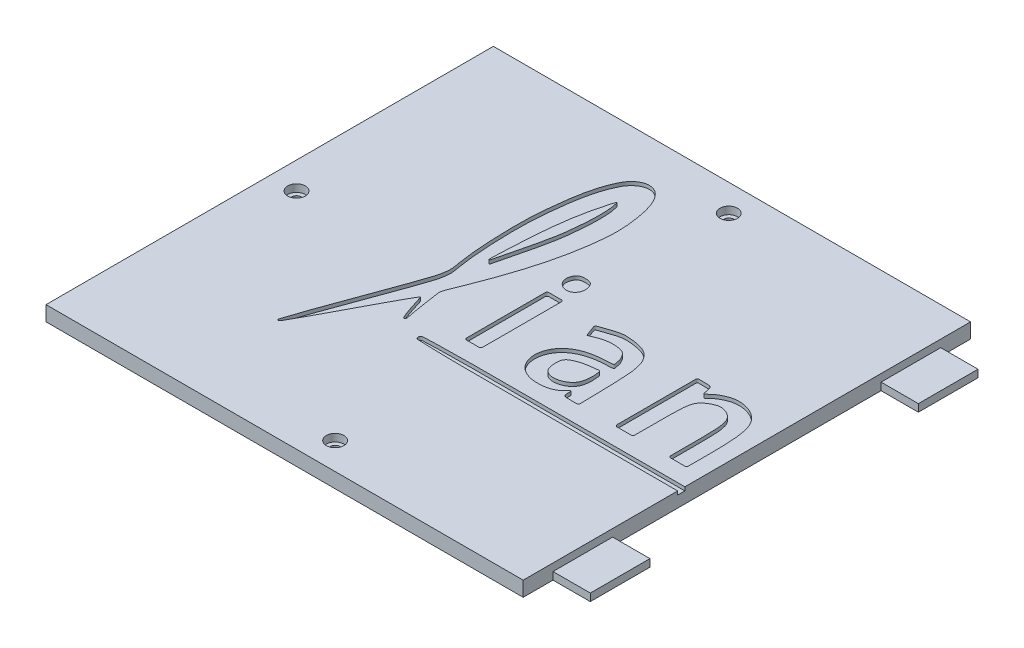
from build123d import *

# Parameters (mm, degrees)
SALIENTE_EXTRUIR1_DEPTH = 5
CROQUIS2_R              = 1.6
CORTAR_EXTRUIR1_DEPTH   = 5
CROQUIS3_R              = 2.95
CORTAR_EXTRUIR2_DEPTH   = 2.5
CORTAR_EXTRUIR3_DEPTH   = 1.2
CROQUIS6_W              = 200
CROQUIS6_H              = 200
CORTAR_EXTRUIR4_DEPTH   = 10
CROQUIS7_W              = 25
CROQUIS7_H              = 20
SALIENTE_EXTRUIR2_DEPTH = 2.5


with BuildPart() as part:
    # Croquis1 → Saliente-Extruir1 (new body)
    with BuildSketch(Plane(origin=(0, 0, 0), x_dir=(1, 0, 0), z_dir=(0, 1, 0))):
        with BuildLine():
            Line((-327.943684306, 75), (-327.943684306, -75))
            Line((-327.943684306, -75), (-27.943684306, -75))
            Line((-27.943684306, -75), (-24, -71.056315694))
            ThreePointArc((-24, -71.056315694), (-75, 0), (-24, 71.056315694))
            Line((-24, 71.056315694), (-27.943684306, 75))
            Line((-27.943684306, 75), (-327.943684306, 75))
        make_face()
    extrude(amount=SALIENTE_EXTRUIR1_DEPTH)

    # Croquis2 → Cortar-Extruir1 (cut)
    with BuildSketch(Plane(origin=(0, 5, 0), x_dir=(1, 0, 0), z_dir=(0, 1, 0))):
        with Locations(Location((-318.943684306, 0, 0), (0, 0, 270))):
            Circle(CROQUIS2_R)
        with Locations(Location((-240.003684306, 66, 0), (0, 0, 270))):
            Circle(CROQUIS2_R)
        with Locations(Location((-240.003684306, -66, 0), (0, 0, 270))):
            Circle(CROQUIS2_R)
        with Locations(Location((-80.003684306, -66, 0), (0, 0, 270))):
            Circle(CROQUIS2_R)
        with Locations(Location((-80.003684306, 66, 0), (0, 0, 270))):
            Circle(CROQUIS2_R)
    extrude(amount=-CORTAR_EXTRUIR1_DEPTH, mode=Mode.SUBTRACT)

    # Croquis3 → Cortar-Extruir2 (cut)
    with BuildSketch(Plane(origin=(0, 5, 0), x_dir=(1, 0, 0), z_dir=(0, 1, 0))):
        with Locations(Location((-240.003684306, -66, 0), (0, 0, 270))):
            Circle(CROQUIS3_R)
        with Locations(Location((-80.003684306, -66, 0), (0, 0, 270))):
            Circle(CROQUIS3_R)
        with Locations(Location((-80.003684306, 66, 0), (0, 0, 270))):
            Circle(CROQUIS3_R)
        with Locations(Location((-240.003684306, 66, 0), (0, 0, 270))):
            Circle(CROQUIS3_R)
        with Locations(Location((-318.943684306, 0, 0), (0, 0, 270))):
            Circle(CROQUIS3_R)
    extrude(amount=-CORTAR_EXTRUIR2_DEPTH, mode=Mode.SUBTRACT)

    # Croquis5 → Cortar-Extruir3 (cut)
    # profile 1 of 8: a face of its own
    with BuildSketch(Plane(origin=(0, 5, 0), x_dir=(1, 0, 0), z_dir=(0, 1, 0))):
        with BuildLine():
            add(Edge.make_bspline(
                [(-264.891156729, -10.407021435), (-265.081782242, -9.126954774), (-265.272407755, -7.846888112), (-265.463033267, -6.566821451), (-265.521878065, -6.17167359), (-265.639567661, -5.381377867), (-265.306395695, -4.136164371), (-265.013698243, -3.392695224), (-264.867349517, -3.020960651), (-264.323801217, -1.640315251), (-263.780252917, -0.259669851), (-263.236704617, 1.120975549), (-263.146110091, 1.3510911), (-262.964921038, 1.811322201), (-262.693137458, 2.501668854), (-262.511948404, 2.961899956), (-262.421353878, 3.192015507), (-262.286159252, 3.535417993), (-262.015770002, 4.222222964), (-261.622702598, 5.257364581), (-261.36372888, 5.948559208), (-261.235388717, 6.294581831), (-260.465266395, 8.370936878), (-259.736580627, 10.46219385), (-259.049619517, 12.567525916), (-258.935135434, 12.918385676), (-258.708492773, 13.620863998), (-258.375503984, 14.676863855), (-258.158193288, 15.382284828), (-258.050708006, 15.735351522), (-257.95079388, 16.063548552), (-257.752987696, 16.720558196), (-257.466111203, 17.709075226), (-257.279858657, 18.369455789), (-257.188095667, 18.700024505), (-256.637447507, 20.683689767), (-256.136048607, 22.680372118), (-255.684205966, 24.688849028), (-255.542968819, 25.31665951), (-255.270207477, 26.574465576), (-254.889499873, 28.467802688), (-254.660504851, 29.734331895), (-254.552226492, 30.368658097), (-254.248810982, 32.146154643), (-253.99433179, 33.93131438), (-253.788980936, 35.722790299), (-253.727480266, 36.259320665), (-253.613308146, 37.33339346), (-253.464179979, 38.948160249), (-253.406720245, 40.02693677), (-253.388844234, 40.566684502), (-253.341216638, 42.004750723), (-253.370631477, 43.443304723), (-253.477004416, 44.878222017), (-253.494722647, 45.117232013), (-253.534425067, 45.594935763), (-253.605016907, 46.310797505), (-253.663515494, 46.786552686), (-253.694001766, 47.02427164), (-253.709589462, 47.145817843), (-253.741411619, 47.388827302), (-253.791085424, 47.753093936), (-253.825491958, 47.995750973), (-253.843017905, 48.117032863), (-253.948179171, 48.84476283), (-254.064943766, 49.570721387), (-254.193281935, 50.294723536), (-254.231271358, 50.509035647), (-254.309275712, 50.937300825), (-254.431163015, 51.5790154), (-254.522854148, 52.004591946), (-254.571419994, 52.216757532), (-254.698807745, 52.773265839), (-254.84483218, 53.325177062), (-255.009328219, 53.871867274), (-255.058863749, 54.036494881), (-255.1612693, 54.364746767), (-255.324303455, 54.854503426), (-255.443228691, 55.177167105), (-255.505287069, 55.337494194), (-255.67173799, 55.767518196), (-255.856694305, 56.189913405), (-256.059807505, 56.603883911), (-256.123005204, 56.732688853), (-256.252881323, 56.988590933), (-256.457645937, 57.368007773), (-256.605701182, 57.613903115), (-256.682598778, 57.735028761), (-256.897305259, 58.073224789), (-257.1338841, 58.396498477), (-257.391301749, 58.703437527), (-257.469249778, 58.796381014), (-257.628869666, 58.97914496), (-257.879201022, 59.244894114), (-258.056439193, 59.410738873), (-258.147619154, 59.490742634), (-258.394639068, 59.707484583), (-258.659481595, 59.902046516), (-258.940161326, 60.072969887), (-259.031168545, 60.128389851), (-259.216299514, 60.234112006), (-259.503667811, 60.377652617), (-259.70056304, 60.459510887), (-259.800300817, 60.497008382), (-260.092877732, 60.607005836), (-260.395035267, 60.687015305), (-260.703708362, 60.73622518), (-260.806814962, 60.752662838), (-261.014136521, 60.778585887), (-261.32859868, 60.796441193), (-261.537520036, 60.794541551), (-261.641836898, 60.79016433), (-261.957533905, 60.776917424), (-262.270363865, 60.732448368), (-262.5772466, 60.65719501), (-262.682663633, 60.631344792), (-262.891731828, 60.572443147), (-263.199749335, 60.462335199), (-263.400174605, 60.37875089), (-263.499217853, 60.334350219), (-263.806777127, 60.196472695), (-264.102059455, 60.033957263), (-264.383095256, 59.847887928), (-264.521383923, 59.756329201), (-264.79059194, 59.562081264), (-265.17369787, 59.240722657), (-265.416411219, 59.014438679), (-265.534489428, 58.897972836), (-266.005303575, 58.43358769), (-266.421262181, 57.919488514), (-266.777152334, 57.362118148), (-266.918082538, 57.141403079), (-267.180322814, 56.687445164), (-267.517342744, 55.974776558), (-267.733393467, 55.497627942), (-267.838420218, 55.257740789), (-268.204660049, 54.421227903), (-268.534112376, 53.569555087), (-268.826151729, 52.704339254), (-268.938707588, 52.37087354), (-269.152614954, 51.700160268), (-269.440831362, 50.683516324), (-269.620708076, 50.002954354), (-269.707309422, 49.661826209), (-270.002471684, 48.499163508), (-270.258720195, 47.327309414), (-270.475770239, 46.14756597), (-270.511934714, 45.950999309), (-270.582079735, 45.557464187), (-270.682123247, 44.966152982), (-270.742128887, 44.570950131), (-270.771722274, 44.373287406), (-270.809732945, 44.119403223), (-270.884403352, 43.611432598), (-270.992356343, 42.848867162), (-271.061616634, 42.340130652), (-271.095569783, 42.085672064), (-271.29929003, 40.558910414), (-271.478614205, 39.029091498), (-271.633496615, 37.496605115), (-271.659311564, 37.241178709), (-271.709582247, 36.730188528), (-271.780910682, 35.963288409), (-271.825740204, 35.451792152), (-271.847474348, 35.195986195), (-271.864332487, 34.997569712), (-271.897229796, 34.600667164), (-271.941504221, 34.004879262), (-271.968744893, 33.607547129), (-271.981717152, 33.408838755), (-272.059566966, 32.216339491), (-272.11406436, 31.02254507), (-272.14518846, 29.827912751), (-272.150375396, 29.628823243), (-272.159450462, 29.230610389), (-272.169752044, 28.633190201), (-272.173045141, 28.234889045), (-272.174334768, 28.035736155), (-272.175833919, 27.804227122), (-272.177867579, 27.34120281), (-272.17802406, 26.646646095), (-272.176199035, 26.183620913), (-272.174804201, 25.952111228), (-272.166434921, 24.563007837), (-272.14070247, 23.174117589), (-272.09761087, 21.78565751), (-272.090400003, 21.553315235), (-272.075006224, 21.088660853), (-272.048999277, 20.391768261), (-272.029718113, 19.927258949), (-272.019591736, 19.695025477), (-272.00969441, 19.46804496), (-271.988971624, 19.014124398), (-271.955003859, 18.333367813), (-271.930479965, 17.8796367), (-271.917745304, 17.652797681), (-271.841018603, 16.286086068), (-271.747138871, 14.920445481), (-271.636120907, 13.55609119), (-271.602367893, 13.141283832), (-271.531694958, 12.31192681), (-271.417301385, 11.068428876), (-271.327745418, 10.240875809), (-271.27957314, 9.827494821), (-271.111951131, 8.389079302), (-270.903311022, 6.956038602), (-270.653823075, 5.529542157), (-270.625733957, 5.368937097), (-270.568522459, 5.047907691), (-270.478397388, 4.566692125), (-270.435279534, 4.24336606), (-270.417788393, 4.081264106), (-270.365246257, 3.59432143), (-270.349489707, 3.104805775), (-270.370608065, 2.615492113), (-270.378282688, 2.437670605), (-270.403374442, 2.082448066), (-270.469851875, 1.551534189), (-270.523064982, 1.199524531), (-270.552131992, 1.023926987), (-270.646764649, 0.452238939), (-270.767360215, -0.1145408), (-270.913667948, -0.675233774), (-270.983347493, -0.942265671), (-271.13430955, -1.473301777), (-271.3867725, -2.262169345), (-271.554863002, -2.787900602), (-271.639686955, -3.050514711), (-271.970657568, -4.075196421), (-272.313460804, -5.095980479), (-272.668050779, -6.112730252), (-272.697599243, -6.197457392), (-272.756859546, -6.366854694), (-272.846077127, -6.620837755), (-272.90615331, -6.78994734), (-272.936191402, -6.874502132), (-272.970277987, -6.970453106), (-273.038451158, -7.162355055), (-273.141673766, -7.449867735), (-273.211128433, -7.641309602), (-273.245855766, -7.737030535), (-273.302936363, -7.894365045), (-273.417097556, -8.209034066), (-273.588339346, -8.681037598), (-273.702500539, -8.995706619), (-273.759581135, -9.153041129), (-276.164569078, -15.782046835), (-278.56955702, -22.41105254), (-280.974544962, -29.040058246), (-281.028313512, -29.188263574), (-281.135850613, -29.484674231), (-281.297156265, -29.929290217), (-281.404693366, -30.225700874), (-281.458461916, -30.373906202), (-281.473289341, -30.414775882), (-281.502944192, -30.496515243), (-281.547314791, -30.619164857), (-281.576820664, -30.700958112), (-281.591573601, -30.74185474), (-281.601444469, -30.769217783), (-281.621186206, -30.823943868), (-281.650752618, -30.906049662), (-281.670452354, -30.960790881), (-281.680298021, -30.988163002), (-281.914066973, -31.638068369), (-282.145466134, -32.28882127), (-282.37449243, -32.940413063), (-282.412664946, -33.049015869), (-282.488878058, -33.266267849), (-282.602801982, -33.592284985), (-282.678487073, -33.809721477), (-282.716263573, -33.918462667), (-282.748372685, -34.010890048), (-282.812495479, -34.195777962), (-282.907917199, -34.473374865), (-282.971224619, -34.658543629), (-283.002787139, -34.751159087), (-283.192172815, -35.306882811), (-283.378272028, -35.863715707), (-283.561078282, -36.42163834), (-283.576312042, -36.468131605), (-283.606733783, -36.561133136), (-283.652274884, -36.700665585), (-283.682467593, -36.79374171), (-283.697563948, -36.840279772), (-283.720366439, -36.910573813), (-283.765971421, -37.051161893), (-283.833742944, -37.26225137), (-283.878498758, -37.403112081), (-283.900876665, -37.473542436), (-283.918972899, -37.53049701), (-283.955165366, -37.644406158), (-284.009454067, -37.81526988), (-284.045646534, -37.929179027), (-284.063742767, -37.986133601), (-284.286575654, -38.687459215), (-284.509408541, -39.388784829), (-284.732241428, -40.090110443), (-284.734909983, -40.09850923), (-284.740247093, -40.115306803), (-284.748252757, -40.140503162), (-284.753589867, -40.157300735), (-284.756258422, -40.165699521), (-284.758987915, -40.174290102), (-284.764446903, -40.191471264), (-284.768281102, -40.218654867), (-284.769684116, -40.236646688), (-284.769973155, -40.245655832), (-284.771715076, -40.299950331), (-284.758780412, -40.352710368), (-284.732123647, -40.400042638), (-284.725377863, -40.412020583), (-284.7102136, -40.43503444), (-284.682035168, -40.466137639), (-284.661913949, -40.484893267), (-284.651571916, -40.493949708), (-284.629531107, -40.513250676), (-284.606262192, -40.531051862), (-284.581867038, -40.547275333), (-284.574187291, -40.552382583), (-284.558614844, -40.562276864), (-284.534603879, -40.576222253), (-284.518070574, -40.584423895), (-284.509678278, -40.588249058), (-284.485876092, -40.599097966), (-284.461169058, -40.607688967), (-284.435770826, -40.613947772), (-284.427963501, -40.615871705), (-284.412238663, -40.619272419), (-284.388272217, -40.623092027), (-284.372221147, -40.624292572), (-284.364184573, -40.624555818), (-284.341934412, -40.625284646), (-284.319749143, -40.623436758), (-284.297926166, -40.619036927), (-284.291010752, -40.617642678), (-284.277282519, -40.614345312), (-284.256906769, -40.607879254), (-284.24397337, -40.60219077), (-284.237675926, -40.599011292), (-284.219535191, -40.589852325), (-284.202999286, -40.578039756), (-284.188453291, -40.563848667), (-284.183631702, -40.559144719), (-284.174466731, -40.549246656), (-284.162330073, -40.532978263), (-284.154248342, -40.52219934), (-284.150211907, -40.516806563), (-283.892119798, -40.171989114), (-283.652478717, -39.814102592), (-283.431949082, -39.444133282), (-283.419415594, -39.423106602), (-283.394474157, -39.380978411), (-283.357311621, -39.317633904), (-283.333001878, -39.275138319), (-283.320847006, -39.253890526), (-283.307455848, -39.230481595), (-283.280673532, -39.183663732), (-283.241198281, -39.113032885), (-283.215354777, -39.065690324), (-283.202433025, -39.042019044), (-283.180169378, -39.001234403), (-283.135642085, -38.919665122), (-283.068851146, -38.7973112), (-283.024323852, -38.715741919), (-283.002060206, -38.674957278), (-282.166955943, -37.145134786), (-281.33185168, -35.615312294), (-280.496747417, -34.085489801), (-280.429659828, -33.962592448), (-280.295484649, -33.716797742), (-280.094221881, -33.348105684), (-279.960046702, -33.102310978), (-279.892959112, -32.979413625), (-279.806727669, -32.821446762), (-279.634264784, -32.505513035), (-279.376326409, -32.031199001), (-279.204872774, -31.71471643), (-279.119145957, -31.556475145), (-279.066743568, -31.459746705), (-278.961938791, -31.266289824), (-278.804937686, -30.975992862), (-278.700320286, -30.782434582), (-278.648030331, -30.685645316), (-278.02055027, -29.524173005), (-277.395771158, -28.361245571), (-276.773696369, -27.196869294), (-276.670017353, -27.002806797), (-276.462809653, -26.614601484), (-276.152449081, -26.032052523), (-275.945843088, -25.643526643), (-275.842615351, -25.44922372), (-275.749812417, -25.274543136), (-275.564328202, -24.925117336), (-275.286821945, -24.400595991), (-275.102147229, -24.050741652), (-275.009903045, -23.875765363), (-274.456436755, -22.825905374), (-273.906327576, -21.774282429), (-273.359581122, -20.720907261), (-273.215114969, -20.442575216), (-272.926652604, -19.885667208), (-272.496170999, -19.049160916), (-272.20757122, -18.492322746), (-272.062677308, -18.214213144), (-271.741676462, -17.598083619), (-271.417763718, -16.983479951), (-271.090946329, -16.370415902), (-271.036477017, -16.268239035), (-270.927377228, -16.063971218), (-270.763243995, -15.757827145), (-270.653500358, -15.553904515), (-270.59854816, -15.451986538), (-270.553512365, -15.368460176), (-270.4633328, -15.201465668), (-270.327025724, -14.951533105), (-270.235768092, -14.785125107), (-270.190021028, -14.701986174), (-269.915534473, -14.203144997), (-269.636800958, -13.706664367), (-269.35384078, -13.21258044), (-269.306681465, -13.130234367), (-269.212128595, -12.96567637), (-269.069688634, -12.719187712), (-268.974108958, -12.555224121), (-268.92624856, -12.473283539), (-268.887731637, -12.407339683), (-268.810606392, -12.275505356), (-268.694644304, -12.07791397), (-268.617153913, -11.946293939), (-268.578363131, -11.880510805), (-268.241666277, -11.309525314), (-267.901541036, -10.740575383), (-267.557999714, -10.173681599), (-267.549636511, -10.159881081), (-267.532906062, -10.132282495), (-267.506637244, -10.088101154), (-267.480237684, -10.068584146), (-267.465722462, -10.061533913), (-267.418484202, -10.03858967), (-267.366353953, -10.044940163), (-267.326005606, -10.078554184), (-267.313607208, -10.088883232), (-267.292664917, -10.114168055), (-267.27777296, -10.163361985), (-267.268144065, -10.194166569), (-267.263328597, -10.209568542), (-266.929685853, -11.276703968), (-266.591148401, -12.342296711), (-266.247723375, -13.406324319), (-266.208726674, -13.527147098), (-266.130607324, -13.768752004), (-266.013050433, -14.131037457), (-265.934427538, -14.37247897), (-265.89505318, -14.493179203), (-265.871516787, -14.565328905), (-265.824399041, -14.709613644), (-265.752075756, -14.925504168), (-265.703407033, -15.069273545), (-265.67891352, -15.141103965), (-265.531922756, -15.572173542), (-265.379213559, -16.001250653), (-265.220812927, -16.428259441), (-265.177124343, -16.54603302), (-265.088883342, -16.781259735), (-264.954142636, -17.133235054), (-264.861793335, -17.366882052), (-264.814949567, -17.48343663), (-264.664534802, -17.857691955), (-264.507247475, -18.229111322), (-264.343141024, -18.597568542), (-264.331209959, -18.624356563), (-264.307276028, -18.677900624), (-264.271169776, -18.75961538), (-264.237169084, -18.807728101), (-264.218054535, -18.82996731), (-264.141827468, -18.918655233), (-264.038666603, -18.973736532), (-263.922563222, -18.987740758), (-263.910373702, -18.989211041), (-263.885877619, -18.991181251), (-263.848500763, -18.991265133), (-263.824113652, -18.987953573), (-263.812085284, -18.985490952), (-263.775624396, -18.978026154), (-263.741401711, -18.963399896), (-263.710808158, -18.94220664), (-263.699891649, -18.934644382), (-263.679155962, -18.917935814), (-263.651641135, -18.888281456), (-263.635050827, -18.867513645), (-263.627179698, -18.8568177), (-263.601575364, -18.822024402), (-263.580644643, -18.784234715), (-263.564733222, -18.744072765), (-263.558600032, -18.728592007), (-263.547872687, -18.697020755), (-263.536313475, -18.64809196), (-263.530115184, -18.615360119), (-263.527432638, -18.598926196), (-263.5182354, -18.542581701), (-263.513957597, -18.485651993), (-263.51463144, -18.428565767), (-263.514878148, -18.407665348), (-263.516701699, -18.365880213), (-263.523361687, -18.303361929), (-263.528931378, -18.261925893), (-263.53203404, -18.24125558), (-263.54220512, -18.173494603), (-263.555775806, -18.106331834), (-263.572711656, -18.039937724), (-263.580389106, -18.009839592), (-263.597119446, -17.949994178), (-263.625005659, -17.861052255), (-263.642073223, -17.801317034), (-263.650373243, -17.771384603), (-263.681880241, -17.657760645), (-263.710005929, -17.543252826), (-263.734725596, -17.427961748), (-263.742963737, -17.389539544), (-263.758680811, -17.312532356), (-263.779879502, -17.196547572), (-263.794020372, -17.119239311), (-263.801078146, -17.08058287), (-263.872044495, -16.691889987), (-263.941730418, -16.302965505), (-264.010135158, -15.913813644), (-264.018869539, -15.8641241), (-264.03629651, -15.764737667), (-264.062311604, -15.615635968), (-264.079571383, -15.516220363), (-264.088180369, -15.466508941), (-264.098458199, -15.407161006), (-264.118954272, -15.288454818), (-264.149484073, -15.110358393), (-264.169709643, -14.991605813), (-264.179789422, -14.93222392), (-264.240268235, -14.57593173), (-264.299558485, -14.219439826), (-264.357659511, -13.862752172), (-264.367342994, -13.803304359), (-264.386643875, -13.684397968), (-264.415416329, -13.50600915), (-264.434433447, -13.387057055), (-264.44391858, -13.327577272), (-264.454258322, -13.262738371), (-264.474882131, -13.133051691), (-264.505650822, -12.938495018), (-264.526051886, -12.808773111), (-264.536224569, -12.743907791), (-264.59726076, -12.354715275), (-264.657294192, -11.965366822), (-264.716324466, -11.575865015), (-264.726165486, -11.51093062), (-264.745791755, -11.381053376), (-264.775119639, -11.186220444), (-264.794466983, -11.05630137), (-264.804140655, -10.991341833), (-264.813809107, -10.926417344), (-264.833146013, -10.796568367), (-264.862151371, -10.601794901), (-264.881488276, -10.471945923), (-264.891156729, -10.407021435)],
                knots=[0, 0, 0, 0, 0.016306659, 0.016306659, 0.016306659, 0.021340414, 0.026374168, 0.031407923, 0.031407923, 0.031407923, 0.050103602, 0.050103602, 0.050103602, 0.053219657, 0.056335711, 0.059451766, 0.059451766, 0.059451766, 0.064101868, 0.068751971, 0.073402073, 0.073402073, 0.073402073, 0.101301958, 0.101301958, 0.101301958, 0.105952168, 0.110602378, 0.115252589, 0.115252589, 0.115252589, 0.119575243, 0.123897897, 0.128220552, 0.128220552, 0.128220552, 0.154154491, 0.154154491, 0.154154491, 0.162262586, 0.170370682, 0.178478777, 0.178478777, 0.178478777, 0.20119341, 0.20119341, 0.20119341, 0.207997943, 0.214802475, 0.221607008, 0.221607008, 0.221607008, 0.239719204, 0.239719204, 0.239719204, 0.242738985, 0.245758767, 0.248778549, 0.248778549, 0.248778549, 0.25032257, 0.25186659, 0.253410611, 0.253410611, 0.253410611, 0.262674441, 0.262674441, 0.262674441, 0.265416863, 0.268159285, 0.270901707, 0.270901707, 0.270901707, 0.278092343, 0.278092343, 0.278092343, 0.280258512, 0.282424682, 0.284590851, 0.284590851, 0.284590851, 0.290397229, 0.290397229, 0.290397229, 0.292204991, 0.294012753, 0.295820515, 0.295820515, 0.295820515, 0.300860634, 0.300860634, 0.300860634, 0.302389047, 0.303917459, 0.305445871, 0.305445871, 0.305445871, 0.309576217, 0.309576217, 0.309576217, 0.31091879, 0.312261363, 0.313603936, 0.313603936, 0.313603936, 0.317529005, 0.317529005, 0.317529005, 0.31884455, 0.320160096, 0.321475642, 0.321475642, 0.321475642, 0.325443847, 0.325443847, 0.325443847, 0.326811451, 0.328179054, 0.329546658, 0.329546658, 0.329546658, 0.333784039, 0.333784039, 0.333784039, 0.335873763, 0.337963488, 0.340053213, 0.340053213, 0.340053213, 0.348350781, 0.348350781, 0.348350781, 0.351650348, 0.354949915, 0.358249482, 0.358249482, 0.358249482, 0.369748154, 0.369748154, 0.369748154, 0.374182702, 0.37861725, 0.383051798, 0.383051798, 0.383051798, 0.398160413, 0.398160413, 0.398160413, 0.400678715, 0.403197017, 0.405715319, 0.405715319, 0.405715319, 0.408949905, 0.41218449, 0.415419076, 0.415419076, 0.415419076, 0.434825072, 0.434825072, 0.434825072, 0.438059831, 0.44129459, 0.44452935, 0.44452935, 0.44452935, 0.447038398, 0.449547447, 0.452056496, 0.452056496, 0.452056496, 0.467112009, 0.467112009, 0.467112009, 0.469621382, 0.472130754, 0.474640127, 0.474640127, 0.474640127, 0.477557194, 0.480474261, 0.483391329, 0.483391329, 0.483391329, 0.500893392, 0.500893392, 0.500893392, 0.503822307, 0.506751221, 0.509680136, 0.509680136, 0.509680136, 0.512542801, 0.515405465, 0.51826813, 0.51826813, 0.51826813, 0.535514861, 0.535514861, 0.535514861, 0.540758694, 0.546002528, 0.551246361, 0.551246361, 0.551246361, 0.569488031, 0.569488031, 0.569488031, 0.571542367, 0.573596702, 0.575651037, 0.575651037, 0.575651037, 0.581810451, 0.581810451, 0.581810451, 0.584053082, 0.586295713, 0.588538344, 0.588538344, 0.588538344, 0.595834555, 0.595834555, 0.595834555, 0.59931181, 0.602789065, 0.60626632, 0.60626632, 0.60626632, 0.619833452, 0.619833452, 0.619833452, 0.620964071, 0.622094689, 0.623225307, 0.623225307, 0.623225307, 0.624508308, 0.625791309, 0.62707431, 0.62707431, 0.62707431, 0.629183153, 0.631291995, 0.633400838, 0.633400838, 0.633400838, 0.722253109, 0.722253109, 0.722253109, 0.724239588, 0.726226067, 0.728212546, 0.728212546, 0.728212546, 0.728760345, 0.729308144, 0.729855943, 0.729855943, 0.729855943, 0.730222464, 0.730588984, 0.730955505, 0.730955505, 0.730955505, 0.739657884, 0.739657884, 0.739657884, 0.741108343, 0.742558802, 0.744009261, 0.744009261, 0.744009261, 0.745242116, 0.74647497, 0.747707825, 0.747707825, 0.747707825, 0.755105281, 0.755105281, 0.755105281, 0.755721739, 0.756338197, 0.756954655, 0.756954655, 0.756954655, 0.757885792, 0.758816929, 0.759748066, 0.759748066, 0.759748066, 0.760501045, 0.761254023, 0.762007001, 0.762007001, 0.762007001, 0.771279003, 0.771279003, 0.771279003, 0.771390041, 0.771501078, 0.771612116, 0.771612116, 0.771612116, 0.771725689, 0.771839263, 0.771952836, 0.771952836, 0.771952836, 0.772620461, 0.772620461, 0.772620461, 0.772793671, 0.772966881, 0.773140091, 0.773140091, 0.773140091, 0.773508696, 0.773508696, 0.773508696, 0.773624905, 0.773741114, 0.773857322, 0.773857322, 0.773857322, 0.774185963, 0.774185963, 0.774185963, 0.774287278, 0.774388592, 0.774489907, 0.774489907, 0.774489907, 0.774769156, 0.774769156, 0.774769156, 0.774858043, 0.77494693, 0.775035817, 0.775035817, 0.775035817, 0.775289883, 0.775289883, 0.775289883, 0.775374757, 0.775459632, 0.775544506, 0.775544506, 0.775544506, 0.780966446, 0.780966446, 0.780966446, 0.781274877, 0.781583309, 0.78189174, 0.78189174, 0.78189174, 0.782231543, 0.782571345, 0.782911148, 0.782911148, 0.782911148, 0.783496614, 0.784082079, 0.784667545, 0.784667545, 0.784667545, 0.806628229, 0.806628229, 0.806628229, 0.808392427, 0.810156625, 0.811920823, 0.811920823, 0.811920823, 0.814188446, 0.816456069, 0.818723692, 0.818723692, 0.818723692, 0.820109826, 0.82149596, 0.822882094, 0.822882094, 0.822882094, 0.839515687, 0.839515687, 0.839515687, 0.842287954, 0.845060222, 0.847832489, 0.847832489, 0.847832489, 0.85032479, 0.852817091, 0.855309391, 0.855309391, 0.855309391, 0.870263176, 0.870263176, 0.870263176, 0.87421441, 0.878165644, 0.882116878, 0.882116878, 0.882116878, 0.890870455, 0.890870455, 0.890870455, 0.892329389, 0.893788322, 0.895247256, 0.895247256, 0.895247256, 0.896442917, 0.897638579, 0.898834241, 0.898834241, 0.898834241, 0.906008145, 0.906008145, 0.906008145, 0.907203807, 0.908399468, 0.90959513, 0.90959513, 0.90959513, 0.910557371, 0.911519611, 0.912481851, 0.912481851, 0.912481851, 0.92083382, 0.92083382, 0.92083382, 0.921037144, 0.921240468, 0.921443791, 0.921443791, 0.921443791, 0.922034939, 0.922034939, 0.922034939, 0.922238267, 0.922441595, 0.922644923, 0.922644923, 0.922644923, 0.936732554, 0.936732554, 0.936732554, 0.938332248, 0.939931943, 0.941531637, 0.941531637, 0.941531637, 0.942487869, 0.943444101, 0.944400333, 0.944400333, 0.944400333, 0.950138547, 0.950138547, 0.950138547, 0.951721301, 0.953304055, 0.954886809, 0.954886809, 0.954886809, 0.959968437, 0.959968437, 0.959968437, 0.96033793, 0.960707422, 0.961076915, 0.961076915, 0.961076915, 0.962483802, 0.962483802, 0.962483802, 0.962638502, 0.962793203, 0.962947904, 0.962947904, 0.962947904, 0.963410486, 0.963410486, 0.963410486, 0.963577814, 0.963745141, 0.963912468, 0.963912468, 0.963912468, 0.964453778, 0.964453778, 0.964453778, 0.964663586, 0.964873393, 0.9650832, 0.9650832, 0.9650832, 0.965800729, 0.965800729, 0.965800729, 0.966064092, 0.966327455, 0.966590818, 0.966590818, 0.966590818, 0.967453439, 0.967453439, 0.967453439, 0.967844817, 0.968236196, 0.968627575, 0.968627575, 0.968627575, 0.970112819, 0.970112819, 0.970112819, 0.970607941, 0.971103062, 0.971598184, 0.971598184, 0.971598184, 0.976576642, 0.976576642, 0.976576642, 0.977212327, 0.977848013, 0.978483698, 0.978483698, 0.978483698, 0.979242611, 0.980001524, 0.980760436, 0.980760436, 0.980760436, 0.985313905, 0.985313905, 0.985313905, 0.986072818, 0.986831731, 0.987590644, 0.987590644, 0.987590644, 0.988417934, 0.989245225, 0.990072515, 0.990072515, 0.990072515, 0.995036256, 0.995036256, 0.995036256, 0.99586377, 0.996691284, 0.997518798, 0.997518798, 0.997518798, 0.998345865, 0.999172933, 1, 1, 1, 1], degree=3, weights=[1, 1, 1, 1, 1, 1, 1, 1, 1, 1, 1, 1, 1, 1, 1, 1, 1, 1, 1, 1, 1, 1, 0.999868208, 0.999868208, 1, 1, 1, 1, 1, 1, 1, 1, 1, 1, 1, 0.999795906, 0.999795906, 1, 1, 1, 1, 1, 1, 0.999748481, 0.999748481, 1, 1, 1, 1, 1, 1, 0.999044298, 0.999044298, 1, 1, 1, 1, 1, 1, 1, 1, 1, 1, 1, 0.999915056, 0.999915056, 1, 1, 1, 1, 1, 1, 0.99962317, 0.99962317, 1, 1, 1, 1, 1, 1, 0.999371907, 0.999371907, 1, 1, 1, 1, 1, 1, 0.998543751, 0.998543751, 1, 1, 1, 1, 1, 1, 0.997501144, 0.997501144, 1, 1, 1, 1, 1, 1, 0.996618695, 0.996618695, 1, 1, 1, 1, 1, 1, 0.996717942, 0.996717942, 1, 1, 1, 1, 1, 1, 0.997776613, 0.997776613, 1, 1, 1, 1, 1, 1, 0.99582257, 0.99582257, 1, 1, 1, 1, 1, 1, 0.999367162, 0.999367162, 1, 1, 1, 1, 1, 1, 0.999629635, 0.999629635, 1, 1, 1, 1, 1, 1, 1, 1, 1, 1, 1, 0.999915066, 0.999915066, 1, 1, 1, 1, 1, 1, 1, 1, 1, 1, 1, 0.999872323, 0.999872323, 1, 1, 1, 1, 1, 1, 1, 1, 1, 1, 1, 0.999947914, 0.999947914, 1, 1, 1, 1, 1, 1, 1, 1, 1, 1, 1, 0.999947455, 0.999947455, 1, 1, 1, 1, 1, 1, 0.999727983, 0.999727983, 1, 1, 1, 1, 1, 1, 0.998110396, 0.998110396, 1, 1, 1, 1, 1, 1, 0.999306928, 0.999306928, 1, 1, 1, 1, 1, 1, 0.999955383, 0.999955383, 1, 1, 1, 1, 1, 1, 1, 1, 1, 1, 1, 1, 1, 1, 1, 1, 1, 1, 1, 1, 1, 1, 1, 1, 1, 1, 1, 1, 1, 1, 1, 1, 1, 1, 0.999995574, 0.999995574, 1, 1, 1, 1, 1, 1, 1, 1, 1, 1, 1, 0.999988365, 0.999988365, 1, 1, 1, 1, 1, 1, 1, 1, 1, 1, 1, 1, 1, 1, 1, 1, 1, 1, 1, 1, 1, 1, 1, 1, 1, 1, 1, 1, 1, 0.975402451, 0.975402451, 1, 1, 1, 1, 1, 1, 0.998540724, 0.998540724, 1, 1, 1, 1, 1, 1, 0.997117546, 0.997117546, 1, 1, 1, 1, 1, 1, 0.995531571, 0.995531571, 1, 1, 1, 1, 1, 1, 0.992237512, 0.992237512, 1, 1, 1, 1, 1, 1, 0.99908138, 0.99908138, 1, 1, 1, 1, 1, 1, 1, 1, 1, 1, 1, 1, 1, 1, 1, 1, 1, 1, 1, 1, 1, 1, 1, 1, 1, 1, 1, 1, 1, 1, 1, 1, 1, 1, 0.9999982, 0.9999982, 1, 1, 1, 1, 1, 1, 1, 1, 1, 1, 1, 0.999996597, 0.999996597, 1, 1, 1, 1, 1, 1, 0.999992536, 0.999992536, 1, 1, 1, 1, 1, 1, 1, 1, 1, 1, 1, 0.999975725, 0.999975725, 1, 1, 1, 1, 1, 1, 1, 1, 1, 1, 1, 0.99998794, 0.99998794, 1, 1, 1, 1, 1, 1, 0.893383151, 0.893383151, 1, 1, 1, 1, 1, 1, 0.999992977, 0.999992977, 1, 1, 1, 1, 1, 1, 1, 1, 1, 1, 1, 0.999941071, 0.999941071, 1, 1, 1, 1, 1, 1, 0.999886749, 0.999886749, 1, 1, 1, 1, 1, 1, 0.954791379, 0.954791379, 1, 1, 1, 1, 1, 1, 0.986452177, 0.986452177, 1, 1, 1, 1, 1, 1, 0.994494742, 0.994494742, 1, 1, 1, 1, 1, 1, 0.997489914, 0.997489914, 1, 1, 1, 1, 1, 1, 0.999154053, 0.999154053, 1, 1, 1, 1, 1, 1, 0.999707152, 0.999707152, 1, 1, 1, 1, 1, 1, 0.999996385, 0.999996385, 1, 1, 1, 1, 1, 1, 1, 1, 1, 1, 1, 0.999996293, 0.999996293, 1, 1, 1, 1, 1, 1, 1, 1, 1, 1, 1, 0.999997788, 0.999997788, 1, 1, 1, 1, 1, 1, 1, 1, 1, 1, 1]))
        make_face()
        with BuildLine():
            add(Edge.make_bspline(
                [(-262.648444967, 48.208929649), (-262.482494967, 48.808929649), (-262.316544967, 49.408929649), (-262.150594967, 50.008929649), (-262.137610325, 50.055876234), (-262.111641039, 50.149769403), (-261.801441683, 50.377525341), (-261.783385939, 50.281794879), (-261.774358067, 50.233929649), (-261.689483467, 49.783929649), (-261.604608867, 49.333929649), (-261.519734267, 48.883929649), (-261.505588432, 48.808929286), (-261.477296762, 48.658928559), (-261.434859257, 48.43392747), (-261.406567586, 48.283926744), (-261.392421751, 48.208926381), (-261.385138178, 48.170309318), (-261.370571033, 48.093075193), (-261.350956552, 47.976800566), (-261.338427137, 47.899208706), (-261.332366838, 47.860380871), (-261.295997142, 47.627363233), (-261.267005042, 47.393313169), (-261.245419462, 47.158464203), (-261.236446616, 47.060840515), (-261.221065127, 46.865357458), (-261.204778937, 46.571630243), (-261.194415653, 46.375833199), (-261.189505174, 46.277921077), (-261.171850875, 45.925904511), (-261.157702306, 45.573729618), (-261.14706087, 45.22143131), (-261.143302463, 45.097004437), (-261.136660771, 44.848124258), (-261.129322723, 44.474725064), (-261.12597091, 44.225779167), (-261.124683925, 44.101302197), (-261.120605691, 43.70685602), (-261.120432877, 43.312388798), (-261.124165499, 42.917939199), (-261.124787591, 42.852198943), (-261.12624873, 42.720720485), (-261.129091324, 42.523508688), (-261.131420244, 42.392042737), (-261.132693167, 42.326311862), (-261.133928778, 42.262507691), (-261.136604396, 42.134903305), (-261.141373278, 41.943511046), (-261.144995557, 41.81592998), (-261.146921773, 41.752142923), (-261.158479356, 41.369411241), (-261.174179089, 40.986827086), (-261.194019133, 40.604435284), (-261.197324727, 40.540724128), (-261.204165727, 40.413313741), (-261.2150155, 40.222227272), (-261.22287663, 40.094875899), (-261.226871501, 40.031204247), (-261.230981061, 39.965704631), (-261.239336285, 39.834713941), (-261.252277438, 39.638253417), (-261.261176964, 39.50729858), (-261.26569475, 39.441825855), (-261.292793724, 39.049101747), (-261.32233958, 38.656554143), (-261.354331172, 38.264198288), (-261.359658945, 38.198856648), (-261.370450121, 38.068184426), (-261.387006323, 37.872205876), (-261.398377299, 37.741582865), (-261.404111899, 37.676275672), (-261.410337465, 37.605377226), (-261.422904361, 37.463590498), (-261.442102005, 37.250940832), (-261.455131857, 37.1091959), (-261.461704639, 37.0383288), (-261.501113468, 36.613426625), (-261.542601697, 36.188722445), (-261.58616833, 35.764226436), (-261.593470959, 35.693072517), (-261.608192979, 35.550776664), (-261.630626307, 35.337368762), (-261.64581526, 35.195121992), (-261.653468088, 35.124004887), (-261.660501829, 35.058640898), (-261.674667897, 34.92792353), (-261.696260668, 34.731884393), (-261.710864235, 34.601215172), (-261.718219593, 34.535886593), (-261.762625232, 34.141486058), (-261.808982978, 33.747310206), (-261.857291698, 33.3533687), (-261.865343782, 33.287706635), (-261.881556324, 33.156395795), (-261.906200262, 32.959469337), (-261.922846161, 32.828212728), (-261.931223263, 32.762591336), (-261.937384409, 32.714328466), (-261.949765286, 32.617810203), (-261.969263439, 32.473150828), (-261.982560716, 32.376754362), (-261.989306752, 32.328569764), (-262.0297888, 32.039420497), (-262.073774992, 31.750783511), (-262.121258858, 31.462701271), (-262.129172594, 31.414689032), (-262.145194184, 31.318696551), (-262.169679237, 31.174780519), (-262.186606232, 31.07894373), (-262.195101773, 31.031031017), (-262.203597353, 30.983118082), (-262.2206526, 30.887303575), (-262.246427737, 30.743615873), (-262.26373924, 30.647847334), (-262.272427011, 30.599968875), (-262.469335592, 29.514802276), (-262.682669228, 28.43274484), (-262.912378909, 27.354045161), (-262.941279402, 27.218330585), (-262.999598022, 26.947011663), (-263.088268171, 26.540282062), (-263.149015539, 26.269497053), (-263.179467161, 26.134122079), (-263.220803089, 25.950360102), (-263.303762163, 25.582900757), (-263.429062468, 25.031905393), (-263.513169805, 24.66470717), (-263.555366929, 24.481141036), (-263.80855083, 23.379739204), (-264.066896363, 22.279536646), (-264.330397849, 21.180557552), (-264.352356221, 21.088976317), (-264.396344535, 20.905831008), (-264.462470191, 20.631147177), (-264.506816235, 20.448088173), (-264.528989257, 20.356558671), (-264.559829163, 20.229252557), (-264.621508975, 19.974640329), (-264.714763857, 19.592899333), (-264.777423197, 19.338526392), (-264.808752868, 19.211339922), (-264.84816869, 19.051326769), (-264.927000334, 18.731300464), (-265.045247801, 18.251261006), (-265.124079445, 17.931234701), (-265.163495267, 17.771221549), (-265.5903349, 16.038416003), (-266.017174533, 14.305610457), (-266.444014166, 12.572804912), (-266.446388527, 12.563165916), (-266.451137248, 12.543887925), (-266.45826033, 12.514970938), (-266.463009051, 12.495692947), (-266.465383412, 12.486053952), (-266.467771256, 12.476360219), (-266.472546944, 12.456972753), (-266.489337079, 12.430168864), (-266.502006307, 12.414637989), (-266.508965612, 12.407479892), (-266.553179915, 12.362002612), (-266.614289692, 12.345011945), (-266.675632613, 12.361140605), (-266.692541857, 12.365586488), (-266.725001369, 12.379646917), (-266.766753879, 12.417962713), (-266.788181232, 12.445723094), (-266.797788337, 12.460331035), (-266.82379675, 12.499877741), (-266.841269388, 12.543867358), (-266.849484076, 12.590481716), (-266.850853388, 12.598251893), (-266.85306078, 12.613885865), (-266.855305061, 12.637650145), (-266.854815494, 12.653422367), (-266.854570711, 12.661308478), (-266.85433024, 12.669055664), (-266.853849297, 12.684550037), (-266.853127883, 12.707791595), (-266.85264694, 12.723285967), (-266.852406469, 12.731033153), (-266.829835769, 13.458186102), (-266.807265068, 14.18533905), (-266.784694367, 14.912491999), (-266.782798499, 14.973570596), (-266.779006761, 15.095727789), (-266.773319154, 15.27896358), (-266.769527416, 15.401120774), (-266.767631547, 15.462199371), (-266.765459153, 15.532186678), (-266.761114365, 15.672161292), (-266.754191426, 15.88211101), (-266.749305679, 16.022067786), (-266.746862805, 16.092046174), (-266.745199061, 16.139705682), (-266.741871573, 16.235024697), (-266.736700783, 16.377996959), (-266.733210066, 16.473310142), (-266.731448386, 16.520966129), (-266.710308157, 17.092839694), (-266.686817726, 17.664621542), (-266.660977491, 18.236302017), (-266.656672817, 18.33153713), (-266.64793306, 18.522001461), (-266.634493575, 18.807683368), (-266.625170884, 18.998120024), (-266.620474974, 19.093336647), (-266.614961968, 19.205121129), (-266.603840677, 19.428685395), (-266.586872904, 19.764017728), (-266.575370524, 19.987562711), (-266.569571701, 20.099332731), (-266.534792607, 20.769686065), (-266.498300208, 21.439948314), (-266.460094744, 22.110115099), (-266.453725959, 22.221830743), (-266.44089319, 22.445256603), (-266.421358435, 22.780379142), (-266.408144895, 23.003782807), (-266.401490532, 23.115481804), (-266.389403833, 23.31836707), (-266.364916403, 23.724118893), (-266.325973601, 24.332615421), (-266.299076604, 24.738214887), (-266.285355839, 24.940996198), (-266.203021482, 26.157828421), (-266.110886098, 27.373957805), (-266.008955668, 28.589305407), (-265.991958877, 28.791963328), (-265.957420761, 29.197233501), (-265.903979915, 29.805002296), (-265.867264407, 30.210081011), (-265.848634578, 30.41259534), (-265.832801042, 30.584712753), (-265.800740913, 30.928911421), (-265.749523017, 31.444922916), (-265.714122356, 31.788794658), (-265.696049027, 31.960691312), (-265.587540541, 32.992722848), (-265.465597096, 34.023253283), (-265.330239387, 35.05210773), (-265.307675829, 35.223613419), (-265.261803811, 35.566526797), (-265.190760843, 36.080604066), (-265.141911807, 36.423106034), (-265.117115509, 36.59430317), (-265.094877981, 36.747834194), (-265.049804904, 37.054809626), (-264.979527459, 37.514887789), (-264.93127172, 37.821379389), (-264.906766317, 37.974564794), (-264.759692768, 38.893934317), (-264.599037481, 39.811028001), (-264.424835601, 40.725645217), (-264.395795695, 40.878114285), (-264.336963974, 41.182909208), (-264.246460298, 41.639673328), (-264.18462522, 41.943873163), (-264.153332827, 42.095895921), (-264.123303427, 42.241782884), (-264.062554217, 42.533414697), (-263.968687809, 42.970299647), (-263.904572889, 43.26121037), (-263.872110715, 43.406575353), (-263.677273345, 44.279053322), (-263.467885231, 45.14815402), (-263.244004832, 46.013634797), (-263.206695195, 46.157867048), (-263.131272617, 46.446123754), (-263.016527985, 46.878108254), (-262.937099474, 47.165285756), (-262.897385219, 47.308874506), (-262.869725191, 47.408880633), (-262.814405135, 47.608892887), (-262.731425051, 47.908911268), (-262.676104995, 48.108923522), (-262.648444967, 48.208929649)],
                knots=[0, 0, 0, 0, 0.024200445, 0.024200445, 0.024200445, 0.026093992, 0.027987539, 0.029881086, 0.029881086, 0.029881086, 0.047683072, 0.047683072, 0.047683072, 0.050650084, 0.053617096, 0.056584108, 0.056584108, 0.056584108, 0.058111798, 0.059639488, 0.061167177, 0.061167177, 0.061167177, 0.070332259, 0.070332259, 0.070332259, 0.074143333, 0.077954407, 0.081765481, 0.081765481, 0.081765481, 0.095466714, 0.095466714, 0.095466714, 0.100305959, 0.105145204, 0.109984449, 0.109984449, 0.109984449, 0.125318687, 0.125318687, 0.125318687, 0.127874424, 0.130430162, 0.132985899, 0.132985899, 0.132985899, 0.135466723, 0.137947547, 0.140428371, 0.140428371, 0.140428371, 0.155313095, 0.155313095, 0.155313095, 0.157793169, 0.160273243, 0.162753317, 0.162753317, 0.162753317, 0.165304592, 0.167855867, 0.170407142, 0.170407142, 0.170407142, 0.185710221, 0.185710221, 0.185710221, 0.188258778, 0.190807335, 0.193355892, 0.193355892, 0.193355892, 0.196122642, 0.198889393, 0.201656144, 0.201656144, 0.201656144, 0.218244786, 0.218244786, 0.218244786, 0.221025393, 0.223805999, 0.226586606, 0.226586606, 0.226586606, 0.229142271, 0.231697937, 0.234253602, 0.234253602, 0.234253602, 0.249682494, 0.249682494, 0.249682494, 0.252254199, 0.254825903, 0.257397608, 0.257397608, 0.257397608, 0.259289032, 0.261180455, 0.263071879, 0.263071879, 0.263071879, 0.2744215, 0.2744215, 0.2744215, 0.276313138, 0.278204777, 0.280096415, 0.280096415, 0.280096415, 0.281988062, 0.283879709, 0.285771357, 0.285771357, 0.285771357, 0.328642309, 0.328642309, 0.328642309, 0.334036451, 0.339430593, 0.344824734, 0.344824734, 0.344824734, 0.352146901, 0.359469067, 0.366791234, 0.366791234, 0.366791234, 0.410724113, 0.410724113, 0.410724113, 0.414385198, 0.418046284, 0.42170737, 0.42170737, 0.42170737, 0.426799483, 0.431891597, 0.43698371, 0.43698371, 0.43698371, 0.443390092, 0.449796474, 0.456202856, 0.456202856, 0.456202856, 0.525578493, 0.525578493, 0.525578493, 0.525964406, 0.526350318, 0.526736231, 0.526736231, 0.526736231, 0.527124335, 0.527512439, 0.527900543, 0.527900543, 0.527900543, 0.530142167, 0.530142167, 0.530142167, 0.530821848, 0.531501529, 0.532181209, 0.532181209, 0.532181209, 0.533995894, 0.533995894, 0.533995894, 0.534302611, 0.534609327, 0.534916044, 0.534916044, 0.534916044, 0.535217358, 0.535518671, 0.535819985, 0.535819985, 0.535819985, 0.564101345, 0.564101345, 0.564101345, 0.566476892, 0.568852438, 0.571227985, 0.571227985, 0.571227985, 0.573950021, 0.576672056, 0.579394092, 0.579394092, 0.579394092, 0.581247963, 0.583101833, 0.584955704, 0.584955704, 0.584955704, 0.607202093, 0.607202093, 0.607202093, 0.610908095, 0.614614098, 0.6183201, 0.6183201, 0.6183201, 0.622670954, 0.627021807, 0.631372661, 0.631372661, 0.631372661, 0.65746734, 0.65746734, 0.65746734, 0.661817287, 0.666167234, 0.670517181, 0.670517181, 0.670517181, 0.678418239, 0.686319297, 0.694220354, 0.694220354, 0.694220354, 0.741631299, 0.741631299, 0.741631299, 0.749537194, 0.75744309, 0.765348986, 0.765348986, 0.765348986, 0.772068225, 0.778787465, 0.785506705, 0.785506705, 0.785506705, 0.825845331, 0.825845331, 0.825845331, 0.83256999, 0.839294649, 0.846019308, 0.846019308, 0.846019308, 0.852050039, 0.858080769, 0.8641115, 0.8641115, 0.8641115, 0.900303365, 0.900303365, 0.900303365, 0.906337083, 0.912370801, 0.918404519, 0.918404519, 0.918404519, 0.92419471, 0.929984901, 0.935775092, 0.935775092, 0.935775092, 0.970524478, 0.970524478, 0.970524478, 0.976315998, 0.982107517, 0.987899036, 0.987899036, 0.987899036, 0.991932691, 0.995966345, 1, 1, 1, 1], degree=3, weights=[1, 1, 1, 1, 1, 1, 1, 1, 1, 1, 1, 1, 1, 1, 1, 1, 1, 1, 1, 1, 1, 1, 0.999667417, 0.999667417, 1, 1, 1, 1, 1, 1, 0.999966955, 0.999966955, 1, 1, 1, 1, 1, 1, 0.999967326, 0.999967326, 1, 1, 1, 1, 1, 1, 1, 1, 1, 1, 1, 0.999960943, 0.999960943, 1, 1, 1, 1, 1, 1, 1, 1, 1, 1, 1, 0.999987054, 0.999987054, 1, 1, 1, 1, 1, 1, 1, 1, 1, 1, 1, 0.999992013, 0.999992013, 1, 1, 1, 1, 1, 1, 1, 1, 1, 1, 1, 0.999991829, 0.999991829, 1, 1, 1, 1, 1, 1, 1, 1, 1, 1, 1, 0.99995096, 0.99995096, 1, 1, 1, 1, 1, 1, 1, 1, 1, 1, 1, 0.999923419, 0.999923419, 1, 1, 1, 1, 1, 1, 1, 1, 1, 1, 1, 0.999992671, 0.999992671, 1, 1, 1, 1, 1, 1, 1, 1, 1, 1, 1, 1, 1, 1, 1, 1, 1, 1, 1, 1, 1, 1, 1, 1, 1, 1, 1, 1, 1, 0.909112578, 0.909112578, 1, 1, 1, 1, 1, 1, 0.986222735, 0.986222735, 1, 1, 1, 1, 1, 1, 1, 1, 1, 1, 1, 1, 1, 1, 1, 1, 1, 1, 1, 1, 1, 1, 1, 1, 1, 1, 1, 1, 1, 0.999994369, 0.999994369, 1, 1, 1, 1, 1, 1, 1, 1, 1, 1, 1, 0.999997822, 0.999997822, 1, 1, 1, 1, 1, 1, 1, 1, 1, 1, 1, 0.999978363, 0.999978363, 1, 1, 1, 1, 1, 1, 1, 1, 1, 1, 1, 0.999943431, 0.999943431, 1, 1, 1, 1, 1, 1, 1, 1, 1, 1, 1, 0.999927078, 0.999927078, 1, 1, 1, 1, 1, 1, 1, 1, 1, 1, 1, 0.999906934, 0.999906934, 1, 1, 1, 1, 1, 1, 1, 1, 1, 1, 1]))
        make_face(mode=Mode.SUBTRACT)
    # profile 2 of 8: a face of its own
    with BuildSketch(Plane(origin=(0, 5, 0), x_dir=(1, 0, 0), z_dir=(0, 1, 0))):
        with BuildLine():
            add(Edge.make_bspline(
                [(-213.531095826, -14.757590837), (-213.209779816, -14.773619048), (-212.888228402, -14.783893789), (-212.566544598, -14.788411771), (-212.524480536, -14.789002552), (-212.440349646, -14.789987202), (-212.31414467, -14.791070351), (-212.230008249, -14.791070351), (-212.187940038, -14.791070351), (-212.116593975, -14.791070351), (-211.973901848, -14.791070351), (-211.759863658, -14.791070351), (-211.617171531, -14.791070351), (-211.545825467, -14.791070351), (-211.117734867, -14.791070351), (-210.689644267, -14.791070351), (-210.261553667, -14.791070351), (-210.161727961, -14.791070351), (-209.962076547, -14.791070351), (-209.626688352, -14.448488714), (-209.630924585, -14.248882248), (-209.633042702, -14.149079015), (-209.681823657, -11.850576127), (-209.730604612, -9.552073239), (-209.779385567, -7.253570351), (-209.785310248, -6.97440616), (-209.79715961, -6.416077777), (-209.814933652, -5.578585202), (-209.826783014, -5.020256819), (-209.832707695, -4.741092628), (-209.837054559, -4.53627335), (-209.845748287, -4.126634795), (-209.863353388, -3.512272574), (-209.876196117, -3.102742258), (-209.883032289, -2.89799095), (-209.92405009, -1.669460127), (-209.979997779, -0.44151864), (-210.050867088, 0.785652083), (-210.062678277, 0.990174251), (-210.087129332, 1.399170731), (-210.126292097, 2.012523137), (-210.15405667, 2.421308048), (-210.168352974, 2.625671541), (-210.176940208, 2.748424753), (-210.194413427, 2.993910278), (-210.231373894, 3.361399872), (-210.25898002, 3.605962044), (-210.273822763, 3.728116801), (-210.362927649, 4.461443913), (-210.489352953, 5.18926599), (-210.652768978, 5.90968499), (-210.699093338, 6.113905773), (-210.797657961, 6.521005407), (-210.959974893, 7.129672961), (-211.094742266, 7.526502205), (-211.169173436, 7.722236912), (-211.353909275, 8.208044346), (-211.58120842, 8.675453473), (-211.849261696, 9.120743978), (-211.93575324, 9.26442386), (-212.117022251, 9.546795713), (-212.41400999, 9.956233075), (-212.630566504, 10.212656946), (-212.743392646, 10.336733363), (-213.072857432, 10.699050194), (-213.439076611, 11.024171776), (-213.837874647, 11.308391159), (-213.947111537, 11.386243201), (-214.170150264, 11.535542048), (-214.518714663, 11.739840929), (-214.757145956, 11.863023083), (-214.877883054, 11.921471279), (-215.163409175, 12.059692976), (-215.456893218, 12.180098622), (-215.757224771, 12.282232658), (-215.872016203, 12.321269889), (-216.10343607, 12.393942529), (-216.455415929, 12.487355374), (-216.690617398, 12.546418182), (-216.8084602, 12.574949782), (-217.207690935, 12.671609835), (-217.609534351, 12.756758028), (-218.013658574, 12.830324036), (-218.149505187, 12.855053296), (-218.42167628, 12.901886719), (-218.831383785, 12.964254172), (-219.105148298, 13.000630154), (-219.2421908, 13.017517757), (-219.656990229, 13.068633056), (-220.073086315, 13.107817078), (-220.490135938, 13.135037512), (-220.616391317, 13.143278081), (-220.869045377, 13.157563674), (-221.248644259, 13.173263499), (-221.501738049, 13.174170358), (-221.628246346, 13.172175741), (-221.969830813, 13.166790085), (-222.31066841, 13.143580473), (-222.649829713, 13.102610193), (-222.749442833, 13.090577047), (-222.948299755, 13.063453466), (-223.245416619, 13.013356451), (-223.442421758, 12.975078148), (-223.540676677, 12.954742439), (-223.796039929, 12.901890196), (-224.049603075, 12.840984683), (-224.301112208, 12.772086888), (-224.409985411, 12.74226243), (-224.62691457, 12.67963018), (-224.950100316, 12.57819426), (-225.165441193, 12.51037052), (-225.27303418, 12.476214677), (-225.670128653, 12.350155379), (-226.066154266, 12.220777328), (-226.461083284, 12.088089586), (-226.526888061, 12.065980581), (-226.658435954, 12.021579049), (-226.855619541, 11.954560875), (-226.986871201, 11.909291555), (-227.052488679, 11.886632707), (-227.12278894, 11.862356813), (-227.26337029, 11.813749499), (-227.474184808, 11.740671944), (-227.614689198, 11.691842617), (-227.684931741, 11.667400213), (-228.291203035, 11.456435071), (-228.896751712, 11.243404623), (-229.501570738, 11.028311344), (-229.518659983, 11.022233854), (-229.552837302, 11.010075582), (-229.605134673, 10.991897904), (-229.636261222, 10.972906839), (-229.650709386, 10.961941951), (-229.695054515, 10.928287891), (-229.727146651, 10.882799639), (-229.743980837, 10.829736502), (-229.750870786, 10.808018652), (-229.75910164, 10.762822528), (-229.75596279, 10.692992846), (-229.753110324, 10.64750018), (-229.751144449, 10.624800583), (-229.743991916, 10.542211587), (-229.729740272, 10.460547692), (-229.708495809, 10.380417961), (-229.70142702, 10.353755947), (-229.685754776, 10.300838797), (-229.657504329, 10.222938229), (-229.638781612, 10.171046192), (-229.629411005, 10.145103514), (-229.495727526, 9.774998613), (-229.360163569, 9.405578359), (-229.22272264, 9.036852306), (-229.214284043, 9.014213266), (-229.19739271, 8.968940455), (-229.172027423, 8.901041749), (-229.15506543, 8.855795368), (-229.146584433, 8.833172177), (-229.132818228, 8.796450609), (-229.105285818, 8.723007475), (-229.063713208, 8.6129451), (-229.035815986, 8.539639761), (-229.021867376, 8.502987092), (-229.009019108, 8.469225787), (-228.983322573, 8.401703177), (-228.94477777, 8.300419263), (-228.919081235, 8.232896654), (-228.906232967, 8.199135349), (-228.747872324, 7.78301217), (-228.589511681, 7.366888992), (-228.431151038, 6.950765814), (-228.429346163, 6.946023155), (-228.425736412, 6.936537836), (-228.420321785, 6.922309859), (-228.416712034, 6.91282454), (-228.414907158, 6.908081881), (-228.413064815, 6.903240769), (-228.40938013, 6.893558546), (-228.401130079, 6.880051542), (-228.395125872, 6.871593089), (-228.39191841, 6.867525808), (-228.372501495, 6.842903838), (-228.346657477, 6.825145892), (-228.316710457, 6.815848906), (-228.308577097, 6.813323923), (-228.291891166, 6.809624298), (-228.265764314, 6.8086505), (-228.248743895, 6.809558349), (-228.240262761, 6.810331299), (-228.219742971, 6.812201424), (-228.199477603, 6.815926203), (-228.179633934, 6.821474891), (-228.176219498, 6.822429636), (-228.169420529, 6.824446065), (-228.159271408, 6.827690361), (-228.152651897, 6.830232349), (-228.149342142, 6.831503343), (-228.146251289, 6.832690275), (-228.140069584, 6.835064139), (-228.130797027, 6.838624935), (-228.124615323, 6.8409988), (-228.12152447, 6.842185732), (-227.973462369, 6.899043721), (-227.825400268, 6.95590171), (-227.677338167, 7.012759699), (-227.6660972, 7.017076393), (-227.643615265, 7.025709781), (-227.609892363, 7.038659863), (-227.587410429, 7.047293252), (-227.576169461, 7.051609946), (-227.5596684, 7.057946592), (-227.526666276, 7.070619885), (-227.477211129, 7.089755397), (-227.444273693, 7.102595873), (-227.427804975, 7.109016111), (-227.417601086, 7.11299404), (-227.397193309, 7.120949899), (-227.366595918, 7.132920306), (-227.346201145, 7.140909444), (-227.336005063, 7.14490734), (-227.213651745, 7.192882217), (-227.091487184, 7.241335736), (-226.969513254, 7.290267154), (-226.959348788, 7.294344761), (-226.939022515, 7.302506607), (-226.908538413, 7.314762648), (-226.888225482, 7.32295764), (-226.878069017, 7.327055136), (-226.860542334, 7.334126052), (-226.825488968, 7.348267885), (-226.772984269, 7.369668367), (-226.738032705, 7.384059967), (-226.720556924, 7.391255766), (-226.704637884, 7.397810564), (-226.672799805, 7.41092016), (-226.625042686, 7.430584555), (-226.593204607, 7.443694151), (-226.577285567, 7.450248949), (-226.437677967, 7.507733549), (-226.298070367, 7.565218149), (-226.158462767, 7.622702749), (-226.126531037, 7.635850906), (-226.062667577, 7.662147222), (-225.966872386, 7.701591695), (-225.903008926, 7.72788801), (-225.871077195, 7.741036168), (-225.862319314, 7.744642299), (-225.844803552, 7.751854561), (-225.81847323, 7.762536316), (-225.800883324, 7.769565816), (-225.792088371, 7.773080565), (-225.786214462, 7.775427971), (-225.774466644, 7.780122781), (-225.756822386, 7.787108634), (-225.745054198, 7.79175216), (-225.739168083, 7.794068789), (-225.244273918, 7.988846817), (-224.7364473, 8.14686846), (-224.218414051, 8.267285517), (-224.083467384, 8.298653929), (-223.812375369, 8.356234027), (-223.40218933, 8.427025295), (-223.12779995, 8.465845142), (-222.990339053, 8.483139126), (-222.566462488, 8.536467126), (-222.140533602, 8.569630404), (-221.713511131, 8.582554314), (-221.577830264, 8.586660719), (-221.306344667, 8.590780916), (-220.898620263, 8.584814465), (-220.627429359, 8.571289812), (-220.491994658, 8.562146405), (-220.104989214, 8.536019066), (-219.719783107, 8.490498676), (-219.337347514, 8.425700001), (-219.226301061, 8.406884641), (-219.004757087, 8.366014167), (-218.672499805, 8.297407597), (-218.456449763, 8.232813219), (-218.350147533, 8.195595366), (-217.998350148, 8.07242633), (-217.669362817, 7.897214036), (-217.370831252, 7.674030444), (-217.337755507, 7.649302862), (-217.272443405, 7.598724931), (-217.176943978, 7.519473686), (-217.115512585, 7.464240901), (-217.085352266, 7.436030737), (-216.994792895, 7.351326906), (-216.909392752, 7.261423879), (-216.829449817, 7.166635348), (-216.800028812, 7.131750792), (-216.742704623, 7.060701577), (-216.661256869, 6.950454507), (-216.608355614, 6.876074158), (-216.582287347, 6.838617874), (-216.496597438, 6.715494015), (-216.415085707, 6.589565135), (-216.337843891, 6.460972962), (-216.311707707, 6.417461443), (-216.260423415, 6.329844894), (-216.186465268, 6.19663107), (-216.139119064, 6.106825959), (-216.115935505, 6.061672055), (-216.045298515, 5.924094562), (-215.97924299, 5.784259594), (-215.917840976, 5.642319665), (-215.898466869, 5.597533521), (-215.860652254, 5.507557366), (-215.806584973, 5.371378448), (-215.77353879, 5.279535663), (-215.757768105, 5.233357311), (-215.713076064, 5.102493954), (-215.674469764, 4.969707847), (-215.642031439, 4.835281839), (-215.636627401, 4.81288724), (-215.626163855, 4.768014903), (-215.611154106, 4.700522041), (-215.60242417, 4.655281849), (-215.598059202, 4.632661752), (-215.593694315, 4.610042078), (-215.584964542, 4.564802728), (-215.571869881, 4.496943704), (-215.563140108, 4.451704355), (-215.558775221, 4.42908468), (-215.481354903, 4.027877836), (-215.403934585, 3.626670992), (-215.326514267, 3.225464149), (-215.305207201, 3.115046867), (-215.262593067, 2.894212304), (-215.851894021, 2.716819481), (-216.076339652, 2.702396326), (-216.188562467, 2.695184749), (-216.823604667, 2.654376149), (-217.458646867, 2.613567549), (-218.093689067, 2.572758949), (-218.199527938, 2.565957611), (-218.41120568, 2.552354937), (-218.728722293, 2.531950925), (-218.940400035, 2.518348251), (-219.046238906, 2.511546914), (-219.182051354, 2.502819437), (-219.453676252, 2.485364484), (-219.860212399, 2.444866718), (-220.130702451, 2.414425163), (-220.265789302, 2.397910539), (-221.076859664, 2.298755643), (-221.880895024, 2.153174165), (-222.675240116, 1.961646875), (-222.922965525, 1.901916945), (-223.416273952, 1.773571681), (-224.151322577, 1.555632611), (-224.630415798, 1.38111491), (-224.867062015, 1.286594486), (-225.53057206, 1.021577566), (-226.168889098, 0.700593287), (-226.77730273, 0.326010318), (-226.969067673, 0.207946097), (-227.346194348, -0.038582712), (-227.893864563, -0.439647407), (-228.237870875, -0.730785034), (-228.404562168, -0.882201566), (-228.878715458, -1.312905807), (-229.307680609, -1.788633023), (-229.687203763, -2.304665639), (-229.812072766, -2.474448373), (-230.0506622, -2.822213208), (-230.375298424, -3.369088944), (-230.564206469, -3.746197773), (-230.651862098, -3.937861372), (-230.91322837, -4.50935234), (-231.11292097, -5.105202255), (-231.248716506, -5.718776885), (-231.291965581, -5.914192261), (-231.365298867, -6.307936642), (-231.435703409, -6.90784735), (-231.453990248, -7.307969455), (-231.456036471, -7.508103072), (-231.461933204, -8.084840996), (-231.409064432, -8.659180876), (-231.297979906, -9.225150516), (-231.261903714, -9.40895676), (-231.177550688, -9.774174593), (-231.014257361, -10.31577804), (-230.877675761, -10.664937091), (-230.802565402, -10.836531557), (-230.581375934, -11.341853178), (-230.302820636, -11.817964159), (-229.970693319, -12.258380061), (-229.858991614, -12.406501593), (-229.6239276, -12.69395114), (-229.235827094, -13.098520148), (-228.959736849, -13.346775342), (-228.817305626, -13.465647568), (-228.382462711, -13.828564798), (-227.909654233, -14.14041319), (-227.404848433, -14.397256296), (-227.230533716, -14.485946904), (-226.875004382, -14.649766887), (-226.321430138, -14.85407291), (-225.947300852, -14.968787106), (-225.758748227, -15.020744322), (-225.169614008, -15.183085071), (-224.568342676, -15.292201667), (-223.959732567, -15.347223326), (-223.795224893, -15.362095713), (-223.46549011, -15.383882624), (-222.968951791, -15.39088329), (-222.638610201, -15.385521875), (-222.473502196, -15.380693869), (-222.09217938, -15.369543415), (-221.711363332, -15.346947837), (-221.331397492, -15.312927511), (-221.215206898, -15.302524361), (-220.983016814, -15.279583656), (-220.635037224, -15.239404767), (-220.404368609, -15.204119799), (-220.289405339, -15.18432267), (-219.975194587, -15.130214338), (-219.664164878, -15.060095662), (-219.357131451, -14.97415043), (-219.259839912, -14.946916444), (-219.06614095, -14.88929003), (-218.778047649, -14.793500434), (-218.589048338, -14.72190563), (-218.495323411, -14.684183332), (-218.228188685, -14.576667265), (-217.967797421, -14.453715825), (-217.715040586, -14.315749708), (-217.630469612, -14.269587044), (-217.463135948, -14.173948903), (-217.217554144, -14.020496061), (-217.058064467, -13.912287094), (-216.979366589, -13.856700359), (-216.741859567, -13.688941838), (-216.514261267, -13.507968026), (-216.297306082, -13.314362876), (-216.261170834, -13.282116722), (-216.189510915, -13.216940198), (-216.083200711, -13.117765495), (-216.014708805, -13.049273589), (-215.980462853, -13.015027636), (-215.946464299, -12.981029082), (-215.878467191, -12.913031975), (-215.776471529, -12.811036313), (-215.708474421, -12.743039205), (-215.674475867, -12.709040651), (-215.470482467, -12.505047251), (-215.266489067, -12.301053851), (-215.062495667, -12.097060451), (-215.037850994, -12.072415778), (-214.988561648, -12.023126431), (-214.756505567, -12.061511858), (-214.756505567, -12.13121752), (-214.756505567, -12.166070351), (-214.756505567, -12.416070351), (-214.756505567, -12.666070351), (-214.756505567, -12.916070351), (-214.756505567, -12.957737281), (-214.756505567, -13.041071142), (-214.756505567, -13.166071932), (-214.756505567, -13.249405793), (-214.756505567, -13.291072723), (-214.756505567, -13.314595233), (-214.756505567, -13.361640252), (-214.754058696, -13.432210927), (-214.751835438, -13.479205487), (-214.750501806, -13.50269016), (-214.742494552, -13.64369431), (-214.726505715, -13.784017663), (-214.702586732, -13.923208785), (-214.696081318, -13.961065576), (-214.681901718, -14.036578313), (-214.659371142, -14.150735379), (-214.633369928, -14.223333419), (-214.617331415, -14.258236472), (-214.579509077, -14.340545543), (-214.525808489, -14.41349456), (-214.458453048, -14.474063173), (-214.43330249, -14.496679525), (-214.379534625, -14.538057022), (-214.289526801, -14.588034686), (-214.228445325, -14.617204622), (-214.197431082, -14.630701534), (-214.09278553, -14.676241635), (-213.983503217, -14.709134926), (-213.871106521, -14.728923181), (-213.833767773, -14.735496939), (-213.758573266, -14.745707848), (-213.644685644, -14.751764486), (-213.568961755, -14.755701971), (-213.531095826, -14.757590837)],
                knots=[0, 0, 0, 0, 0.008384819, 0.008384819, 0.008384819, 0.009481352, 0.010577886, 0.01167442, 0.01167442, 0.01167442, 0.0135341, 0.015393779, 0.017253458, 0.017253458, 0.017253458, 0.028411904, 0.028411904, 0.028411904, 0.031013923, 0.033615941, 0.03621796, 0.03621796, 0.03621796, 0.096143349, 0.096143349, 0.096143349, 0.103421575, 0.110699801, 0.117978026, 0.117978026, 0.117978026, 0.12331797, 0.128657913, 0.133997856, 0.133997856, 0.133997856, 0.166036536, 0.166036536, 0.166036536, 0.171376415, 0.176716294, 0.182056173, 0.182056173, 0.182056173, 0.185263631, 0.188471089, 0.191678547, 0.191678547, 0.191678547, 0.210917021, 0.210917021, 0.210917021, 0.216375393, 0.221833765, 0.227292136, 0.227292136, 0.227292136, 0.240803701, 0.240803701, 0.240803701, 0.245175014, 0.249546327, 0.253917641, 0.253917641, 0.253917641, 0.266633845, 0.266633845, 0.266633845, 0.270130296, 0.273626748, 0.277123199, 0.277123199, 0.277123199, 0.285381384, 0.285381384, 0.285381384, 0.288541777, 0.29170217, 0.294862564, 0.294862564, 0.294862564, 0.305566474, 0.305566474, 0.305566474, 0.309165592, 0.312764709, 0.316363826, 0.316363826, 0.316363826, 0.327254618, 0.327254618, 0.327254618, 0.330552544, 0.333850471, 0.337148398, 0.337148398, 0.337148398, 0.346045021, 0.346045021, 0.346045021, 0.348660374, 0.351275727, 0.353891081, 0.353891081, 0.353891081, 0.360686081, 0.360686081, 0.360686081, 0.363628481, 0.366570881, 0.36951328, 0.36951328, 0.36951328, 0.38037257, 0.38037257, 0.38037257, 0.382182034, 0.383991498, 0.385800962, 0.385800962, 0.385800962, 0.387739559, 0.389678155, 0.391616751, 0.391616751, 0.391616751, 0.408348928, 0.408348928, 0.408348928, 0.4088217, 0.409294472, 0.409767244, 0.409767244, 0.409767244, 0.411173012, 0.411173012, 0.411173012, 0.411766906, 0.4123608, 0.412954693, 0.412954693, 0.412954693, 0.415110113, 0.415110113, 0.415110113, 0.415829085, 0.416548057, 0.417267029, 0.417267029, 0.417267029, 0.427523982, 0.427523982, 0.427523982, 0.428153744, 0.428783505, 0.429413267, 0.429413267, 0.429413267, 0.430435486, 0.431457704, 0.432479922, 0.432479922, 0.432479922, 0.433421502, 0.434363082, 0.435304662, 0.435304662, 0.435304662, 0.446910058, 0.446910058, 0.446910058, 0.447042327, 0.447174597, 0.447306866, 0.447306866, 0.447306866, 0.447441882, 0.447576897, 0.447711912, 0.447711912, 0.447711912, 0.44850475, 0.44850475, 0.44850475, 0.448726732, 0.448948714, 0.449170696, 0.449170696, 0.449170696, 0.449706296, 0.449706296, 0.449706296, 0.44979871, 0.449891123, 0.449983536, 0.449983536, 0.449983536, 0.450069837, 0.450156138, 0.450242439, 0.450242439, 0.450242439, 0.45437655, 0.45437655, 0.45437655, 0.454690414, 0.455004278, 0.455318142, 0.455318142, 0.455318142, 0.455778876, 0.45623961, 0.456700344, 0.456700344, 0.456700344, 0.456985811, 0.457271278, 0.457556745, 0.457556745, 0.457556745, 0.460982341, 0.460982341, 0.460982341, 0.461267808, 0.461553275, 0.461838742, 0.461838742, 0.461838742, 0.462331363, 0.462823984, 0.463316606, 0.463316606, 0.463316606, 0.463765344, 0.464214083, 0.464662821, 0.464662821, 0.464662821, 0.468598191, 0.468598191, 0.468598191, 0.469498308, 0.470398425, 0.471298542, 0.471298542, 0.471298542, 0.471545416, 0.47179229, 0.472039164, 0.472039164, 0.472039164, 0.472204045, 0.472368925, 0.472533805, 0.472533805, 0.472533805, 0.486371861, 0.486371861, 0.486371861, 0.489983109, 0.493594357, 0.497205605, 0.497205605, 0.497205605, 0.508332951, 0.508332951, 0.508332951, 0.511871176, 0.515409401, 0.518947626, 0.518947626, 0.518947626, 0.529049628, 0.529049628, 0.529049628, 0.531985377, 0.534921126, 0.537856876, 0.537856876, 0.537856876, 0.547497202, 0.547497202, 0.547497202, 0.548573639, 0.549650076, 0.550726512, 0.550726512, 0.550726512, 0.553954862, 0.553954862, 0.553954862, 0.55514436, 0.556333857, 0.557523354, 0.557523354, 0.557523354, 0.561431925, 0.561431925, 0.561431925, 0.562754958, 0.564077991, 0.565401024, 0.565401024, 0.565401024, 0.569430651, 0.569430651, 0.569430651, 0.570702577, 0.571974503, 0.573246428, 0.573246428, 0.573246428, 0.57684834, 0.57684834, 0.57684834, 0.577448824, 0.578049308, 0.578649792, 0.578649792, 0.578649792, 0.579250264, 0.579850737, 0.58045121, 0.58045121, 0.58045121, 0.591101841, 0.591101841, 0.591101841, 0.594033031, 0.596964222, 0.599895412, 0.599895412, 0.599895412, 0.616482322, 0.616482322, 0.616482322, 0.619246768, 0.622011214, 0.62477566, 0.62477566, 0.62477566, 0.628322997, 0.631870334, 0.635417671, 0.635417671, 0.635417671, 0.656692672, 0.656692672, 0.656692672, 0.663334831, 0.66997699, 0.676619149, 0.676619149, 0.676619149, 0.695196663, 0.695196663, 0.695196663, 0.701066519, 0.706936376, 0.712806232, 0.712806232, 0.712806232, 0.729447844, 0.729447844, 0.729447844, 0.734941351, 0.740434858, 0.745928366, 0.745928366, 0.745928366, 0.762247782, 0.762247782, 0.762247782, 0.767464661, 0.77268154, 0.777898419, 0.777898419, 0.777898419, 0.792880126, 0.792880126, 0.792880126, 0.797762559, 0.802644993, 0.807527427, 0.807527427, 0.807527427, 0.821840235, 0.821840235, 0.821840235, 0.826675899, 0.831511564, 0.836347228, 0.836347228, 0.836347228, 0.851048407, 0.851048407, 0.851048407, 0.856146327, 0.861244248, 0.866342169, 0.866342169, 0.866342169, 0.882228293, 0.882228293, 0.882228293, 0.886533774, 0.890839256, 0.895144738, 0.895144738, 0.895144738, 0.905085412, 0.905085412, 0.905085412, 0.908126107, 0.911166801, 0.914207496, 0.914207496, 0.914207496, 0.922510881, 0.922510881, 0.922510881, 0.925144325, 0.92777777, 0.930411215, 0.930411215, 0.930411215, 0.937908496, 0.937908496, 0.937908496, 0.940419907, 0.942931318, 0.94544273, 0.94544273, 0.94544273, 0.953013915, 0.953013915, 0.953013915, 0.954276302, 0.955538688, 0.956801074, 0.956801074, 0.956801074, 0.958054341, 0.959307608, 0.960560874, 0.960560874, 0.960560874, 0.96808055, 0.96808055, 0.96808055, 0.968989011, 0.969897472, 0.970805932, 0.970805932, 0.970805932, 0.977322337, 0.977322337, 0.977322337, 0.978408411, 0.979494485, 0.980580559, 0.980580559, 0.980580559, 0.981193688, 0.981806817, 0.982419946, 0.982419946, 0.982419946, 0.98609728, 0.98609728, 0.98609728, 0.987098504, 0.988099728, 0.989100952, 0.989100952, 0.989100952, 0.991429473, 0.991429473, 0.991429473, 0.992311111, 0.993192749, 0.994074388, 0.994074388, 0.994074388, 0.997035322, 0.997035322, 0.997035322, 0.998023548, 0.999011774, 1, 1, 1, 1], degree=3, weights=[1, 0.999893212, 0.999893212, 1, 1, 1, 1, 1, 1, 1, 1, 1, 1, 1, 1, 1, 1, 1, 1, 1, 1, 1, 1, 1, 1, 1, 1, 1, 1, 1, 1, 1, 1, 1, 1, 0.999950749, 0.999950749, 1, 1, 1, 1, 1, 1, 1, 1, 1, 1, 1, 0.999130721, 0.999130721, 1, 1, 1, 1, 1, 1, 0.997346854, 0.997346854, 1, 1, 1, 1, 1, 1, 0.996199419, 0.996199419, 1, 1, 1, 1, 1, 1, 0.998738817, 0.998738817, 1, 1, 1, 1, 1, 1, 0.999724707, 0.999724707, 1, 1, 1, 1, 1, 1, 0.999725128, 0.999725128, 1, 1, 1, 1, 1, 1, 0.99909104, 0.99909104, 1, 1, 1, 1, 1, 1, 0.999666217, 0.999666217, 1, 1, 1, 1, 1, 1, 0.999976655, 0.999976655, 1, 1, 1, 1, 1, 1, 1, 1, 1, 1, 1, 0.999996127, 0.999996127, 1, 1, 1, 1, 1, 1, 0.968788226, 0.968788226, 1, 1, 1, 1, 1, 1, 0.997513949, 0.997513949, 1, 1, 1, 1, 1, 1, 0.999991379, 0.999991379, 1, 1, 1, 1, 1, 1, 1, 1, 1, 1, 1, 1, 1, 1, 1, 1, 1, 1, 1, 1, 1, 1, 1, 1, 1, 1, 1, 1, 1, 0.97002398, 0.97002398, 1, 1, 1, 1, 1, 1, 0.997248538, 0.997248538, 1, 1, 1, 1, 1, 1, 1, 1, 1, 1, 1, 1, 1, 1, 1, 1, 1, 1, 1, 1, 1, 1, 1, 1, 1, 1, 1, 1, 1, 0.999994891, 0.999994891, 1, 1, 1, 1, 1, 1, 1, 1, 1, 1, 1, 1, 1, 1, 1, 1, 1, 1, 1, 1, 1, 1, 1, 1, 1, 1, 1, 1, 1, 1, 1, 1, 1, 1, 0.998210791, 0.998210791, 1, 1, 1, 1, 1, 1, 0.999249692, 0.999249692, 1, 1, 1, 1, 1, 1, 0.999159603, 0.999159603, 1, 1, 1, 1, 1, 1, 0.992253287, 0.992253287, 1, 1, 1, 1, 1, 1, 0.998836928, 0.998836928, 1, 1, 1, 1, 1, 1, 0.999624848, 0.999624848, 1, 1, 1, 1, 1, 1, 0.999636439, 0.999636439, 1, 1, 1, 1, 1, 1, 0.999289964, 0.999289964, 1, 1, 1, 1, 1, 1, 1, 1, 1, 1, 1, 1, 1, 1, 1, 1, 1, 1, 1, 1, 1, 1, 1, 1, 1, 1, 1, 1, 1, 1, 1, 1, 0.998899192, 0.998899192, 1, 1, 1, 1, 1, 1, 0.9975402, 0.9975402, 1, 1, 1, 1, 1, 1, 0.996694481, 0.996694481, 1, 1, 1, 1, 1, 1, 0.996288646, 0.996288646, 1, 1, 1, 1, 1, 1, 0.996533878, 0.996533878, 1, 1, 1, 1, 1, 1, 0.995460133, 0.995460133, 1, 1, 1, 1, 1, 1, 0.995792348, 0.995792348, 1, 1, 1, 1, 1, 1, 0.997339893, 0.997339893, 1, 1, 1, 1, 1, 1, 0.999699383, 0.999699383, 1, 1, 1, 1, 1, 1, 0.999126302, 0.999126302, 1, 1, 1, 1, 1, 1, 0.998859452, 0.998859452, 1, 1, 1, 1, 1, 1, 0.998924429, 0.998924429, 1, 1, 1, 1, 1, 1, 1, 1, 1, 1, 1, 1, 1, 1, 1, 1, 1, 1, 1, 1, 1, 1, 1, 1, 1, 1, 1, 1, 1, 1, 1, 1, 0.998927634, 0.998927634, 1, 1, 1, 1, 1, 1, 0.986198802, 0.986198802, 1, 1, 1, 1, 1, 1, 0.995356442, 0.995356442, 1, 1, 1, 1, 1, 1]))
        make_face()
        with BuildLine():
            add(Edge.make_bspline(
                [(-225.265303414, -4.520044874), (-225.365374201, -4.720074049), (-225.439755551, -4.931008276), (-225.487289397, -5.149563456), (-225.506068298, -5.235906692), (-225.535085802, -5.410450603), (-225.554558964, -5.675970917), (-225.564168494, -5.852450471), (-225.567732261, -5.94074034), (-225.580149311, -6.248364187), (-225.57749782, -6.556227118), (-225.559784139, -6.863591462), (-225.553903512, -6.965630949), (-225.538824214, -7.169518701), (-225.506231315, -7.474818403), (-225.477885681, -7.677288792), (-225.462061303, -7.778265165), (-225.41470553, -8.08044539), (-225.352627576, -8.379947953), (-225.275976018, -8.676056036), (-225.254198032, -8.760185281), (-225.208302172, -8.927838061), (-225.134837978, -9.179275053), (-225.069952171, -9.340781668), (-225.033292729, -9.419573139), (-224.941740968, -9.616343669), (-224.824858503, -9.799206612), (-224.684717599, -9.964919899), (-224.621199633, -10.040028384), (-224.485064393, -10.182550221), (-224.256128165, -10.373925206), (-224.096019667, -10.488520785), (-224.013777665, -10.542484378), (-223.698340403, -10.74946047), (-223.354751587, -10.905301718), (-222.991235932, -11.006277643), (-222.861504948, -11.042313798), (-222.598043479, -11.099987811), (-222.192650199, -11.142711471), (-221.923524508, -11.155244168), (-221.788897292, -11.157304605), (-221.353920023, -11.163961829), (-220.920479627, -11.126827403), (-220.492973661, -11.046278084), (-220.348181611, -11.018996825), (-220.060462851, -10.954534239), (-219.634502571, -10.82783772), (-219.357732918, -10.726249095), (-219.221078346, -10.671162503), (-218.801974691, -10.502218342), (-218.401032303, -10.293807199), (-218.021957379, -10.047855567), (-217.901588995, -9.969758076), (-217.665629891, -9.806199482), (-217.324694687, -9.538560217), (-217.11534435, -9.341877869), (-217.015205037, -9.239116574), (-216.633702676, -8.847625202), (-216.322751352, -8.398048935), (-216.091041715, -7.902952792), (-216.070372072, -7.858787773), (-216.030357797, -7.769837617), (-215.974319595, -7.634537027), (-215.939614521, -7.543385084), (-215.922924141, -7.497567901), (-215.872835765, -7.360069035), (-215.828754245, -7.22052835), (-215.790762435, -7.079208125), (-215.776501692, -7.026161653), (-215.749707403, -6.919604378), (-215.714549146, -6.758505899), (-215.692327157, -6.650914505), (-215.681575395, -6.597047106), (-215.645684916, -6.417232247), (-215.613805555, -6.2366631), (-215.585953106, -6.055429132), (-215.576480918, -5.993794253), (-215.558469777, -5.870381073), (-215.534257498, -5.68482788), (-215.519889814, -5.560938042), (-215.513150488, -5.498944799), (-215.492524567, -5.309212504), (-215.476066664, -5.119073318), (-215.463784703, -4.928618794), (-215.459910114, -4.868536119), (-215.452992848, -4.748317122), (-215.444998129, -4.567801547), (-215.442281097, -4.447410146), (-215.441576514, -4.387206792), (-215.439581472, -4.216739756), (-215.44282863, -4.046291973), (-215.451314918, -3.876024614), (-215.452729013, -3.847652459), (-215.455848018, -3.790922645), (-215.461108964, -3.705846869), (-215.465680495, -3.649216344), (-215.46796626, -3.620901081), (-215.470252049, -3.592585523), (-215.474823628, -3.535954407), (-215.481680996, -3.451007733), (-215.486252575, -3.394376617), (-215.488538364, -3.366061059), (-215.528815832, -2.86711789), (-215.5690933, -2.368174721), (-215.609370767, -1.869231551), (-215.617818936, -1.764578603), (-215.634715272, -1.555272707), (-216.104514822, -1.340448407), (-216.312930886, -1.366084103), (-216.417138917, -1.378901951), (-216.924227817, -1.441275151), (-217.431316717, -1.503648351), (-217.938405617, -1.566021551), (-218.02291914, -1.576416925), (-218.191946184, -1.597207674), (-218.44548675, -1.628393796), (-218.614513794, -1.649184544), (-218.699027316, -1.659579918), (-218.760149144, -1.667098055), (-218.8823928, -1.68213433), (-219.0653877, -1.707716901), (-219.187263064, -1.725501852), (-219.248159466, -1.734668555), (-219.61358572, -1.789675979), (-219.977392505, -1.85453573), (-220.33931424, -1.92920046), (-220.453454389, -1.95274766), (-220.681333339, -2.001787514), (-221.022098428, -2.080940982), (-221.24766964, -2.139738536), (-221.360041309, -2.170642457), (-221.678195216, -2.258139628), (-221.992803927, -2.357633461), (-222.303415258, -2.468980956), (-222.39813256, -2.502935075), (-222.586781863, -2.573033964), (-222.867594671, -2.684533955), (-223.05217592, -2.764767302), (-223.143792562, -2.80636827), (-223.393355026, -2.919688729), (-223.637676885, -3.043905392), (-223.876282684, -3.178776528), (-223.945433311, -3.21786369), (-224.082734728, -3.297806869), (-224.28709767, -3.421856742), (-224.416222338, -3.514639148), (-224.478756046, -3.563620277), (-224.638903849, -3.689060148), (-224.784899648, -3.830720683), (-224.915108621, -3.987015607), (-224.960466992, -4.041461034), (-225.047160383, -4.153703733), (-225.165159642, -4.332433574), (-225.233597889, -4.456669436), (-225.265303414, -4.520044874)],
                knots=[0, 0, 0, 0, 0.020525835, 0.020525835, 0.020525835, 0.028677153, 0.03682847, 0.044979787, 0.044979787, 0.044979787, 0.073358319, 0.073358319, 0.073358319, 0.082787017, 0.092215714, 0.101644412, 0.101644412, 0.101644412, 0.129838067, 0.129838067, 0.129838067, 0.13785475, 0.145871433, 0.153888117, 0.153888117, 0.153888117, 0.173790328, 0.173790328, 0.173790328, 0.182864505, 0.191938682, 0.201012859, 0.201012859, 0.201012859, 0.235538943, 0.235538943, 0.235538943, 0.247959673, 0.260380404, 0.272801135, 0.272801135, 0.272801135, 0.312796495, 0.312796495, 0.312796495, 0.326388496, 0.339980496, 0.353572497, 0.353572497, 0.353572497, 0.395129137, 0.395129137, 0.395129137, 0.408365481, 0.421601825, 0.434838169, 0.434838169, 0.434838169, 0.484795096, 0.484795096, 0.484795096, 0.489293408, 0.49379172, 0.498290031, 0.498290031, 0.498290031, 0.511781154, 0.511781154, 0.511781154, 0.516848405, 0.521915657, 0.526982908, 0.526982908, 0.526982908, 0.543895116, 0.543895116, 0.543895116, 0.549647647, 0.555400178, 0.561152709, 0.561152709, 0.561152709, 0.578755689, 0.578755689, 0.578755689, 0.584309791, 0.589863893, 0.595417995, 0.595417995, 0.595417995, 0.611139592, 0.611139592, 0.611139592, 0.613760154, 0.616380717, 0.619001279, 0.619001279, 0.619001279, 0.621621869, 0.624242458, 0.626863048, 0.626863048, 0.626863048, 0.67303997, 0.67303997, 0.67303997, 0.682725544, 0.692411118, 0.702096692, 0.702096692, 0.702096692, 0.749227869, 0.749227869, 0.749227869, 0.757082944, 0.76493802, 0.772793096, 0.772793096, 0.772793096, 0.77847404, 0.784154984, 0.789835928, 0.789835928, 0.789835928, 0.823917759, 0.823917759, 0.823917759, 0.834668847, 0.845419934, 0.856171022, 0.856171022, 0.856171022, 0.886595609, 0.886595609, 0.886595609, 0.89587768, 0.90515975, 0.91444182, 0.91444182, 0.91444182, 0.939709649, 0.939709649, 0.939709649, 0.947037302, 0.954364955, 0.961692607, 0.961692607, 0.961692607, 0.980388561, 0.980388561, 0.980388561, 0.986925707, 0.993462854, 1, 1, 1, 1], degree=3, weights=[1, 0.994810232, 0.994810232, 1, 1, 1, 1, 1, 1, 0.9992013, 0.9992013, 1, 1, 1, 1, 1, 1, 0.999202211, 0.999202211, 1, 1, 1, 1, 1, 1, 0.994090169, 0.994090169, 1, 1, 1, 1, 1, 1, 0.992020777, 0.992020777, 1, 1, 1, 1, 1, 1, 0.996618098, 0.996618098, 1, 1, 1, 1, 1, 1, 0.996918761, 0.996918761, 1, 1, 1, 1, 1, 1, 0.990683805, 0.990683805, 1, 1, 1, 1, 1, 1, 0.999373465, 0.999373465, 1, 1, 1, 1, 1, 1, 0.999834848, 0.999834848, 1, 1, 1, 1, 1, 1, 0.999839501, 0.999839501, 1, 1, 1, 1, 1, 1, 0.999684811, 0.999684811, 1, 1, 1, 1, 1, 1, 1, 1, 1, 1, 1, 1, 1, 1, 1, 1, 1, 1, 1, 1, 1, 1, 1, 1, 1, 1, 1, 1, 1, 1, 1, 1, 0.999756665, 0.999756665, 1, 1, 1, 1, 1, 1, 0.999520905, 0.999520905, 1, 1, 1, 1, 1, 1, 0.999351325, 0.999351325, 1, 1, 1, 1, 1, 1, 0.996267429, 0.996267429, 1, 1, 1, 1, 1, 1]))
        make_face(mode=Mode.SUBTRACT)
    # profile 3 of 8: a face of its own
    with BuildSketch(Plane(origin=(0, 5, 0), x_dir=(1, 0, 0), z_dir=(0, 1, 0))):
        with BuildLine():
            add(Edge.make_bspline(
                [(-98.816304656, -23.861750274), (-98.732556665, -23.309714459), (-98.738942072, -22.751398693), (-98.835293673, -22.20142266), (-98.859393825, -22.063858721), (-98.91879123, -21.790692491), (-99.040956416, -21.385832396), (-99.146351121, -21.126797321), (-99.205273925, -21.000176794), (-99.325459313, -20.741907733), (-99.470856855, -20.496944491), (-99.640010384, -20.267740392), (-99.699439206, -20.187213963), (-99.823971245, -20.030348829), (-100.027607081, -19.808016597), (-100.169194735, -19.666457034), (-100.24157146, -19.597334675), (-100.470909194, -19.378308945), (-100.715509663, -19.176470699), (-100.974087793, -18.992880346), (-101.058787615, -18.932743511), (-101.231045984, -18.816496217), (-101.498139497, -18.654135231), (-101.680966808, -18.555323629), (-101.773569838, -18.508257955), (-102.047486434, -18.369039302), (-102.331026726, -18.250645729), (-102.622610121, -18.153737219), (-102.712055985, -18.124009651), (-102.892311023, -18.068656509), (-103.167361596, -17.996625989), (-103.353411617, -17.965105788), (-103.446954112, -17.95352595), (-103.705120891, -17.921566898), (-103.965258288, -17.921529934), (-104.22343414, -17.953415616), (-104.290070066, -17.961645402), (-104.422817959, -17.982347429), (-104.618419951, -18.03248946), (-104.751078446, -18.055183251), (-104.81786815, -18.062054317), (-104.961269771, -18.076806921), (-105.105307837, -18.070916279), (-105.247025933, -18.044503298), (-105.300715629, -18.034496778), (-105.407004115, -18.008630515), (-105.562276178, -17.953135937), (-105.663896504, -17.913022631), (-105.71427895, -17.891943661), (-105.88474043, -17.820626114), (-106.049912578, -17.737792119), (-106.209018444, -17.643831317), (-106.275893633, -17.604337825), (-106.407364782, -17.521491372), (-106.598095441, -17.387033616), (-106.723658988, -17.295575725), (-106.785955365, -17.249194822), (-107.011861358, -17.081003274), (-107.23122481, -16.904363555), (-107.443729967, -16.71952992), (-107.5381177, -16.637432959), (-107.724125427, -16.470056937), (-107.996179929, -16.211377733), (-108.177455976, -16.038938824), (-108.267886238, -15.95250201), (-108.606974384, -15.628388178), (-108.943127638, -15.301231433), (-109.276318695, -14.971058349), (-109.331854895, -14.916025184), (-109.442761946, -14.805791995), (-109.608793501, -14.640106799), (-109.718869306, -14.52904379), (-109.773907209, -14.473512286), (-109.880790276, -14.365670649), (-110.094556412, -14.149987375), (-110.415205615, -13.826462463), (-110.62897175, -13.610779189), (-110.735854817, -13.502937551), (-111.377184717, -12.855855951), (-112.018514617, -12.208774351), (-112.659844517, -11.561692751), (-112.861944591, -11.357780165), (-113.266144737, -10.949954992), (-114.193192771, -10.591070351), (-114.767387102, -10.591070351), (-115.054484267, -10.591070351), (-116.487129167, -10.591070351), (-117.919774067, -10.591070351), (-119.352418967, -10.591070351), (-120.785064017, -10.591070351), (-122.217709067, -10.591070351), (-123.650354117, -10.591070351), (-123.982223922, -10.591070351), (-124.645963532, -10.591070351), (-125.649209326, -11.160237231), (-126.117320287, -11.630792644), (-126.351375767, -11.866070351), (-127.619752367, -13.141070351), (-128.888128967, -14.416070351), (-130.156505567, -15.691070351), (-131.424882167, -16.966070351), (-132.693258767, -18.241070351), (-133.961635367, -19.516070351), (-134.221900739, -19.777694816), (-134.742431482, -20.300943745), (-135.921357626, -20.791070351), (-136.659423813, -20.791070351), (-137.028456907, -20.791070351), (-151.54478696, -20.791070351), (-166.061117014, -20.791070351), (-180.577447067, -20.791070351), (-183.369586742, -20.791070351), (-188.953866091, -20.791070351), (-197.330285687, -20.791906517), (-202.914564307, -20.794758873), (-205.706703617, -20.796185051), (-214.661612898, -20.800759069), (-223.616522178, -20.805333087), (-232.571431458, -20.809907105), (-232.892842089, -20.810071276), (-233.535663352, -20.810399618), (-234.499895246, -20.810892132), (-235.142716509, -20.811220474), (-235.46412714, -20.811384645), (-235.671984378, -20.811490815), (-236.087698853, -20.811703155), (-236.71127075, -20.81291435), (-237.126982913, -20.81431693), (-237.334838995, -20.815018221), (-237.511260731, -20.815613454), (-237.864104203, -20.816803921), (-238.393366884, -20.81935067), (-238.74620737, -20.821232997), (-238.922627217, -20.822243345), (-241.039673684, -20.834367577), (-243.156639653, -20.856454384), (-245.273478241, -20.888503279), (-245.626378183, -20.893846177), (-246.332169685, -20.905085701), (-247.390832113, -20.92360618), (-248.096584869, -20.937060529), (-248.449455751, -20.944064545), (-248.641818016, -20.947882679), (-249.026539279, -20.955683485), (-249.603583871, -20.969281157), (-249.988261282, -20.97901465), (-250.180594454, -20.984091061), (-251.808982124, -21.027070463), (-253.436903779, -21.085076666), (-255.064220753, -21.158104729), (-255.13285596, -21.161184827), (-255.270123977, -21.167398459), (-255.481674861, -21.175339282), (-255.613891354, -21.216550215), (-255.67642076, -21.245016897), (-255.870756065, -21.333488571), (-256.018228144, -21.487908238), (-256.097666217, -21.686107734), (-256.122886088, -21.749031792), (-256.157714726, -21.881136816), (-256.157688571, -22.101195829), (-256.122842675, -22.233295469), (-256.097617477, -22.296217391), (-256.018112816, -22.494534411), (-255.870521895, -22.649025677), (-255.676042019, -22.737502843), (-255.613467082, -22.765970844), (-255.48115761, -22.807169478), (-255.269472454, -22.815042398), (-255.132118498, -22.821214344), (-255.063440346, -22.824273956), (-253.426952108, -22.897179515), (-251.789865531, -22.955114956), (-250.152317556, -22.998075432), (-249.959008943, -23.003146814), (-249.572380766, -23.012872155), (-248.992410322, -23.026461643), (-248.605738743, -23.034263706), (-248.412401328, -23.038082441), (-248.057755433, -23.045087285), (-247.348452705, -23.05854315), (-246.284465471, -23.077065477), (-245.575124176, -23.088305948), (-245.220449356, -23.09364925), (-243.093258628, -23.12569613), (-240.965941152, -23.147781133), (-238.838543578, -23.159903776), (-238.661261135, -23.160913993), (-238.306695462, -23.162796057), (-237.77484501, -23.16534242), (-237.420276366, -23.16653264), (-237.242992043, -23.16712775), (-237.034143781, -23.167828815), (-236.616447255, -23.169230943), (-235.989898835, -23.170441729), (-235.572200009, -23.170653977), (-235.363350597, -23.170760101), (-235.040344396, -23.170924232), (-234.394331994, -23.171252495), (-233.425313392, -23.171744888), (-232.779300991, -23.17207315), (-232.45629479, -23.172237282), (-223.456463549, -23.176810421), (-214.456632308, -23.181383561), (-205.456801067, -23.185956701), (-202.650762039, -23.187382551), (-197.038683982, -23.190234251), (-188.62056524, -23.191070351), (-183.008486458, -23.191070351), (-180.202447067, -23.191070351), (-165.611117014, -23.191070351), (-151.01978696, -23.191070351), (-136.428456907, -23.191070351), (-136.059423813, -23.191070351), (-135.321357626, -23.191070351), (-134.142431482, -22.700943745), (-133.621900739, -22.177694816), (-133.361635367, -21.916070351), (-132.093258767, -20.641070351), (-130.824882167, -19.366070351), (-129.556505567, -18.091070351), (-128.288128967, -16.816070351), (-127.019752367, -15.541070351), (-125.751375767, -14.266070351), (-125.533739593, -14.047297691), (-125.098467243, -13.60975237), (-124.209803097, -12.991070351), (-123.592625711, -12.991070351), (-123.284037017, -12.991070351), (-122.085074867, -12.991070351), (-120.886112717, -12.991070351), (-119.687150567, -12.991070351), (-118.488188567, -12.991070351), (-117.289226567, -12.991070351), (-116.090264567, -12.991070351), (-115.842666727, -12.991070351), (-115.347471047, -12.991070351), (-114.558920753, -13.319983913), (-114.206932929, -13.668298905), (-114.030939017, -13.842456401), (-113.457363317, -14.410047101), (-112.883787617, -14.977637801), (-112.310211917, -15.545228501), (-112.214612782, -15.639830104), (-112.023414511, -15.829033309), (-111.736617104, -16.112838116), (-111.545418832, -16.302041321), (-111.449819697, -16.396642923), (-111.390136956, -16.455702902), (-111.270771475, -16.573822859), (-111.092605155, -16.751894326), (-110.974044185, -16.870821996), (-110.914844545, -16.930366208), (-110.4625795, -17.385263664), (-110.01505707, -17.844827633), (-109.572325403, -18.309008673), (-109.519752918, -18.364128179), (-109.414743728, -18.474496698), (-109.257205538, -18.640307486), (-109.157536427, -18.755572202), (-109.109025036, -18.81429759), (-108.963329109, -18.990669566), (-108.829882919, -19.176482622), (-108.709296373, -19.370887514), (-108.673317403, -19.428891395), (-108.60370169, -19.546352006), (-108.505132709, -19.726921847), (-108.449895453, -19.851898218), (-108.425011618, -19.915457098), (-108.358695855, -20.084842387), (-108.312152356, -20.260691353), (-108.285989793, -20.440704344), (-108.2754765, -20.513041649), (-108.261116422, -20.658685149), (-108.25795764, -20.87872011), (-108.257933628, -21.024924863), (-108.258783289, -21.098017223), (-108.26177746, -21.355591591), (-108.275463322, -21.61281954), (-108.299817273, -21.869257457), (-108.307535303, -21.95052541), (-108.325111222, -22.112858091), (-108.358728029, -22.35550061), (-108.378093382, -22.517622554), (-108.387014235, -22.598767279), (-108.412404199, -22.829716233), (-108.431615425, -23.061261042), (-108.444634199, -23.293236431), (-108.448254195, -23.357739431), (-108.454535675, -23.486799223), (-108.46265928, -23.680787708), (-108.460055659, -23.810050311), (-108.45648608, -23.87455612), (-108.447883343, -24.030016031), (-108.42617123, -24.184192473), (-108.391505139, -24.335981976), (-108.380106297, -24.385893132), (-108.354527598, -24.485080308), (-108.307768537, -24.632048506), (-108.270941563, -24.727637582), (-108.251124503, -24.774842891), (-108.192192812, -24.915221367), (-108.121110621, -25.049855624), (-108.038431863, -25.177696478), (-108.004867582, -25.229594771), (-107.93401321, -25.330981759), (-107.817951991, -25.476067352), (-107.739795074, -25.571841162), (-107.700303966, -25.619385313), (-107.560348412, -25.787880664), (-107.4152779, -25.951992781), (-107.26522963, -26.111566454), (-107.21521444, -26.164756721), (-107.114093355, -26.270111657), (-106.959149635, -26.425322565), (-106.851633139, -26.524178264), (-106.796863803, -26.572459146), (-106.246272737, -27.057822389), (-105.606962771, -27.418392447), (-104.906755416, -27.638478021), (-104.732419939, -27.693274251), (-104.378004579, -27.784590755), (-103.827213168, -27.866247985), (-103.461238764, -27.876596065), (-103.278579436, -27.8710233), (-102.73326901, -27.854386387), (-102.199156297, -27.743193505), (-101.692510546, -27.540831626), (-101.525668359, -27.474192365), (-101.199693041, -27.321612975), (-100.73358742, -27.033030025), (-100.451971439, -26.808883329), (-100.31816948, -26.688991119), (-99.913382815, -26.326285161), (-99.578301728, -25.898349979), (-99.32326391, -25.418387932), (-99.23790893, -25.257756262), (-99.0862067, -24.92639277), (-98.917221487, -24.398387702), (-98.843588239, -24.041593573), (-98.816304656, -23.861750274)],
                knots=[0, 0, 0, 0, 0.004880292, 0.004880292, 0.004880292, 0.006111734, 0.007343176, 0.008574618, 0.008574618, 0.008574618, 0.011078017, 0.011078017, 0.011078017, 0.011960484, 0.01284295, 0.013725417, 0.013725417, 0.013725417, 0.016516763, 0.016516763, 0.016516763, 0.0174327, 0.018348637, 0.019264574, 0.019264574, 0.019264574, 0.02196885, 0.02196885, 0.02196885, 0.022799956, 0.023631062, 0.024462167, 0.024462167, 0.024462167, 0.026744368, 0.026744368, 0.026744368, 0.027336394, 0.02792842, 0.028520445, 0.028520445, 0.028520445, 0.029782864, 0.029782864, 0.029782864, 0.030264424, 0.030745985, 0.031227545, 0.031227545, 0.031227545, 0.032854278, 0.032854278, 0.032854278, 0.033539098, 0.034223918, 0.034908738, 0.034908738, 0.034908738, 0.037390916, 0.037390916, 0.037390916, 0.038493947, 0.039596978, 0.040700008, 0.040700008, 0.040700008, 0.044835952, 0.044835952, 0.044835952, 0.045525348, 0.046214745, 0.046904142, 0.046904142, 0.046904142, 0.048242943, 0.049581745, 0.050920546, 0.050920546, 0.050920546, 0.05895375, 0.05895375, 0.05895375, 0.061485226, 0.064016702, 0.066548177, 0.066548177, 0.066548177, 0.079180506, 0.079180506, 0.079180506, 0.091812836, 0.091812836, 0.091812836, 0.094739094, 0.097665352, 0.10059161, 0.10059161, 0.10059161, 0.116449376, 0.116449376, 0.116449376, 0.132307142, 0.132307142, 0.132307142, 0.135561087, 0.138815032, 0.142068977, 0.142068977, 0.142068977, 0.270066539, 0.270066539, 0.270066539, 0.294686196, 0.319305854, 0.343925511, 0.343925511, 0.343925511, 0.422885324, 0.422885324, 0.422885324, 0.425719359, 0.428553394, 0.431387428, 0.431387428, 0.431387428, 0.433220207, 0.435052986, 0.436885765, 0.436885765, 0.436885765, 0.43844137, 0.439996976, 0.441552581, 0.441552581, 0.441552581, 0.46021978, 0.46021978, 0.46021978, 0.463331828, 0.466443876, 0.469555923, 0.469555923, 0.469555923, 0.471252409, 0.472948895, 0.474645381, 0.474645381, 0.474645381, 0.489008262, 0.489008262, 0.489008262, 0.489614061, 0.49021986, 0.490825659, 0.490825659, 0.490825659, 0.492618329, 0.492618329, 0.492618329, 0.493216066, 0.493813803, 0.49441154, 0.49441154, 0.49441154, 0.496205294, 0.496205294, 0.496205294, 0.496811463, 0.497417632, 0.498023802, 0.498023802, 0.498023802, 0.512467426, 0.512467426, 0.512467426, 0.514172509, 0.515877592, 0.517582675, 0.517582675, 0.517582675, 0.52071037, 0.523838066, 0.526965762, 0.526965762, 0.526965762, 0.545724231, 0.545724231, 0.545724231, 0.547287443, 0.548850654, 0.550413865, 0.550413865, 0.550413865, 0.552255392, 0.55409692, 0.555938447, 0.555938447, 0.555938447, 0.558786551, 0.561634654, 0.564482758, 0.564482758, 0.564482758, 0.64383867, 0.64383867, 0.64383867, 0.668580888, 0.693323105, 0.718065323, 0.718065323, 0.718065323, 0.846724197, 0.846724197, 0.846724197, 0.849978142, 0.853232087, 0.856486032, 0.856486032, 0.856486032, 0.872343798, 0.872343798, 0.872343798, 0.888201564, 0.888201564, 0.888201564, 0.890922541, 0.893643518, 0.896364495, 0.896364495, 0.896364495, 0.906936329, 0.906936329, 0.906936329, 0.917508162, 0.917508162, 0.917508162, 0.919691353, 0.921874544, 0.924057735, 0.924057735, 0.924057735, 0.931172897, 0.931172897, 0.931172897, 0.932358797, 0.933544697, 0.934730597, 0.934730597, 0.934730597, 0.935470956, 0.936211316, 0.936951676, 0.936951676, 0.936951676, 0.942607569, 0.942607569, 0.942607569, 0.943279207, 0.943950844, 0.944622481, 0.944622481, 0.944622481, 0.946636559, 0.946636559, 0.946636559, 0.947238409, 0.947840259, 0.948442109, 0.948442109, 0.948442109, 0.950039055, 0.950039055, 0.950039055, 0.95068359, 0.951328124, 0.951972659, 0.951972659, 0.951972659, 0.954242666, 0.954242666, 0.954242666, 0.954962469, 0.955682272, 0.956402076, 0.956402076, 0.956402076, 0.958450247, 0.958450247, 0.958450247, 0.959019897, 0.959589546, 0.960159195, 0.960159195, 0.960159195, 0.961528783, 0.961528783, 0.961528783, 0.961980206, 0.962431628, 0.96288305, 0.96288305, 0.96288305, 0.964221997, 0.964221997, 0.964221997, 0.964766971, 0.965311946, 0.96585692, 0.96585692, 0.96585692, 0.967787688, 0.967787688, 0.967787688, 0.968431469, 0.96907525, 0.96971903, 0.96971903, 0.96971903, 0.976097017, 0.976097017, 0.976097017, 0.977708363, 0.979319709, 0.980931054, 0.980931054, 0.980931054, 0.985692717, 0.985692717, 0.985692717, 0.987276851, 0.988860986, 0.990445121, 0.990445121, 0.990445121, 0.995188268, 0.995188268, 0.995188268, 0.996792179, 0.998396089, 1, 1, 1, 1], degree=3, weights=[1, 0.991271556, 0.991271556, 1, 1, 1, 1, 1, 1, 0.996661642, 0.996661642, 1, 1, 1, 1, 1, 1, 0.998248746, 0.998248746, 1, 1, 1, 1, 1, 1, 0.998141837, 0.998141837, 1, 1, 1, 1, 1, 1, 0.994961426, 0.994961426, 1, 1, 1, 1, 1, 1, 0.993158253, 0.993158253, 1, 1, 1, 1, 1, 1, 0.998432044, 0.998432044, 1, 1, 1, 1, 1, 1, 0.999520198, 0.999520198, 1, 1, 1, 1, 1, 1, 0.999972924, 0.999972924, 1, 1, 1, 1, 1, 1, 1, 1, 1, 1, 1, 1, 1, 1, 1, 1, 1, 1, 1, 1, 1, 1, 1, 1, 1, 1, 1, 1, 1, 1, 1, 1, 1, 1, 1, 1, 1, 1, 1, 1, 1, 1, 1, 1, 1, 1, 1, 1, 1, 1, 1, 1, 1, 1, 1, 1, 1, 1, 1, 1, 1, 1, 1, 1, 1, 1, 1, 0.999992618, 0.999992618, 1, 1, 1, 1, 1, 1, 1, 1, 1, 1, 1, 0.999971607, 0.999971607, 1, 1, 1, 1, 1, 1, 0.952147367, 0.952147367, 1, 1, 1, 1, 1, 1, 0.952125996, 0.952125996, 1, 1, 1, 1, 1, 1, 0.999972117, 0.999972117, 1, 1, 1, 1, 1, 1, 1, 1, 1, 1, 1, 0.99999269, 0.99999269, 1, 1, 1, 1, 1, 1, 1, 1, 1, 1, 1, 1, 1, 1, 1, 1, 1, 1, 1, 1, 1, 1, 1, 1, 1, 1, 1, 1, 1, 1, 1, 1, 1, 1, 1, 1, 1, 1, 1, 1, 1, 1, 1, 1, 1, 1, 1, 1, 1, 1, 1, 1, 1, 1, 1, 1, 1, 1, 1, 1, 1, 1, 1, 1, 1, 1, 1, 0.999964138, 0.999964138, 1, 1, 1, 1, 1, 1, 0.998476527, 0.998476527, 1, 1, 1, 1, 1, 1, 0.995640852, 0.995640852, 1, 1, 1, 1, 1, 1, 0.999425138, 0.999425138, 1, 1, 1, 1, 1, 1, 0.99976207, 0.99976207, 1, 1, 1, 1, 1, 1, 0.997614271, 0.997614271, 1, 1, 1, 1, 1, 1, 0.997402387, 0.997402387, 1, 1, 1, 1, 1, 1, 0.999684749, 0.999684749, 1, 1, 1, 1, 1, 1, 0.985493989, 0.985493989, 1, 1, 1, 1, 1, 1, 0.989846557, 0.989846557, 1, 1, 1, 1, 1, 1, 0.98971623, 0.98971623, 1, 1, 1, 1, 1, 1]))
        make_face()
    # profile 4 of 8: a face of its own
    with BuildSketch(Plane(origin=(0, 5, 0), x_dir=(1, 0, 0), z_dir=(0, 1, 0))):
        with BuildLine():
            add(Edge.make_bspline(
                [(-189.926155154, 10.854554965), (-190.044078356, 10.767135035), (-190.15852603, 10.675211939), (-190.269326316, 10.578923714), (-190.287786867, 10.562881032), (-190.324500749, 10.530557218), (-190.379167174, 10.481585161), (-190.414817471, 10.44809345), (-190.432642619, 10.431347595), (-190.450468511, 10.41460104), (-190.486120295, 10.381107931), (-190.539597972, 10.330868268), (-190.575249756, 10.297375159), (-190.593075648, 10.280628605), (-190.880190888, 10.010897869), (-191.167306128, 9.741167134), (-191.454421367, 9.471436399), (-191.491129536, 9.436950869), (-191.564545872, 9.367979809), (-191.856816928, 9.46048595), (-191.876572121, 9.559261949), (-191.886449717, 9.608649949), (-191.947407417, 9.913438549), (-192.008365117, 10.218227149), (-192.069322817, 10.523015749), (-192.079482476, 10.573814056), (-192.099801792, 10.675410671), (-192.130280767, 10.827805594), (-192.150600083, 10.929402209), (-192.160759741, 10.980200517), (-192.166663352, 11.009718583), (-192.178470575, 11.068754714), (-192.198222906, 11.15690243), (-192.211879689, 11.215539541), (-192.218892078, 11.244814022), (-192.26097918, 11.420514207), (-192.309661159, 11.594502551), (-192.364868781, 11.766531611), (-192.379544159, 11.812260652), (-192.409812021, 11.903424415), (-192.455551414, 12.040894637), (-192.496334506, 12.128127793), (-192.51971504, 12.170078508), (-192.572511856, 12.264809629), (-192.639744085, 12.349905554), (-192.719689873, 12.42318693), (-192.747589634, 12.448760922), (-192.806261072, 12.496775812), (-192.902757188, 12.55903728), (-192.969397514, 12.595062499), (-193.003379752, 12.611724831), (-193.111296146, 12.664638908), (-193.225000789, 12.703588899), (-193.34269514, 12.727958705), (-193.400900573, 12.740010729), (-193.518815635, 12.756850237), (-193.697368759, 12.766554179), (-193.816009614, 12.774116119), (-193.875347174, 12.777605767), (-194.112013808, 12.791524154), (-194.348907587, 12.800806119), (-194.585937689, 12.805448104), (-194.625441455, 12.806221743), (-194.704454037, 12.80751118), (-194.822988691, 12.808929649), (-194.902011373, 12.808929649), (-194.941522714, 12.808929649), (-195.008604142, 12.808929649), (-195.142766999, 12.808929649), (-195.344011283, 12.808929649), (-195.478174139, 12.808929649), (-195.545255567, 12.808929649), (-195.947755567, 12.808929649), (-196.350255567, 12.808929649), (-196.752755567, 12.808929649), (-196.847625727, 12.808929649), (-197.037366047, 12.808929649), (-197.356505567, 12.489790128), (-197.356505567, 12.300049809), (-197.356505567, 12.205179649), (-197.356505567, 7.806429649), (-197.356505567, 3.407679649), (-197.356505567, -0.991070351), (-197.356505567, -5.341070351), (-197.356505567, -9.691070351), (-197.356505567, -14.041070351), (-197.356505567, -14.158921481), (-197.356505567, -14.394623742), (-196.960058958, -14.791070351), (-196.724356698, -14.791070351), (-196.606505567, -14.791070351), (-195.856505567, -14.791070351), (-195.106505567, -14.791070351), (-194.356505567, -14.791070351), (-193.606505567, -14.791070351), (-192.856505567, -14.791070351), (-192.106505567, -14.791070351), (-191.988597488, -14.791070351), (-191.75278133, -14.791070351), (-191.356122492, -14.394794774), (-191.355894532, -14.158978726), (-191.355780551, -14.041070702), (-191.353810923, -12.003570585), (-191.351841295, -9.966070468), (-191.349871667, -7.928570351), (-191.349625947, -7.674382757), (-191.349134507, -7.166007568), (-191.348397346, -6.403444785), (-191.347905906, -5.895069596), (-191.347660185, -5.640882002), (-191.347479439, -5.45390766), (-191.347117948, -5.079958977), (-191.343792301, -4.51903813), (-191.340900474, -4.145100111), (-191.339201535, -3.958133401), (-191.326331681, -2.541817241), (-191.298943399, -1.125707436), (-191.257039567, 0.290047192), (-191.25178171, 0.467688122), (-191.240808988, 0.822956454), (-191.223799982, 1.356225699), (-191.197598464, 1.710768438), (-191.180932499, 1.887703993), (-191.130890072, 2.418983418), (-191.048834223, 2.946267886), (-190.93506487, 3.467630146), (-190.90305355, 3.614326012), (-190.834036277, 3.906627839), (-190.71923163, 4.344440335), (-190.616232262, 4.62693494), (-190.55768255, 4.765196768), (-190.413475726, 5.105733011), (-190.227854698, 5.425585124), (-190.003728054, 5.719741185), (-189.92414315, 5.824192765), (-189.75565729, 6.025997736), (-189.475585663, 6.306498271), (-189.280889524, 6.482899263), (-189.181276356, 6.568462726), (-188.861910994, 6.842783955), (-188.520465713, 7.089079491), (-188.159392733, 7.305580472), (-188.065967624, 7.361598587), (-187.876657057, 7.469531528), (-187.584869923, 7.617979571), (-187.388000706, 7.711325165), (-187.289063623, 7.756907328), (-187.077019651, 7.854599948), (-186.862727207, 7.947256532), (-186.646305877, 8.034825374), (-186.585303208, 8.059508399), (-186.46296912, 8.108061967), (-186.278717826, 8.179627195), (-186.153748259, 8.221080627), (-186.090734496, 8.240050158), (-185.935934105, 8.286650946), (-185.778308857, 8.32255465), (-185.618597022, 8.347593108), (-185.566285538, 8.355794121), (-185.461294544, 8.369848649), (-185.302625878, 8.383905439), (-185.196773946, 8.388043193), (-185.1438291, 8.388812178), (-184.98727882, 8.391085955), (-184.830975385, 8.382008718), (-184.67574074, 8.361628202), (-184.614481301, 8.353585545), (-184.492423238, 8.333990278), (-184.310963026, 8.29487313), (-184.190466572, 8.267463676), (-184.130336736, 8.253257829), (-183.921613259, 8.203946307), (-183.714403225, 8.148618941), (-183.508879982, 8.087322019), (-183.411364777, 8.058238291), (-183.217132774, 7.997393847), (-182.928422005, 7.895004907), (-182.741552059, 7.814137538), (-182.649455242, 7.770856425), (-182.289502439, 7.60169577), (-181.952504201, 7.390476605), (-181.643351692, 7.140264547), (-181.541335951, 7.05769828), (-181.343889171, 6.884429937), (-181.06734424, 6.599578492), (-180.900722582, 6.396468126), (-180.821768679, 6.291631676), (-180.584933803, 5.977157957), (-180.388929089, 5.635739401), (-180.236781061, 5.272647875), (-180.17305142, 5.120561168), (-180.061475276, 4.809732165), (-179.937695857, 4.328403765), (-179.862481332, 4.007251995), (-179.827475604, 3.846110962), (-179.700443641, 3.261347754), (-179.607849453, 2.670152824), (-179.550010402, 2.074552477), (-179.540377727, 1.97535956), (-179.52304806, 1.776785751), (-179.50108359, 1.478414699), (-179.493296707, 1.279247724), (-179.489485172, 1.179661101), (-179.482098245, 0.986657741), (-179.467939675, 0.60062747), (-179.448547675, 0.02151068), (-179.436850672, -0.364602017), (-179.431309911, -0.557667198), (-179.398065212, -1.716062847), (-179.375900422, -2.874723458), (-179.36481757, -4.033543056), (-179.362970479, -4.226674264), (-179.359891974, -4.612942569), (-179.356505567, -5.192363426), (-179.356505567, -5.578643507), (-179.356505567, -5.771783547), (-179.356505567, -6.022320576), (-179.356505567, -6.523394632), (-179.356505567, -7.275005717), (-179.356505567, -7.776079773), (-179.356505567, -8.026616801), (-179.356505567, -10.031434651), (-179.356505567, -12.036252501), (-179.356505567, -14.041070351), (-179.356505567, -14.158921481), (-179.356505567, -14.394623742), (-178.960058958, -14.791070351), (-178.724356698, -14.791070351), (-178.606505567, -14.791070351), (-177.856505567, -14.791070351), (-177.106505567, -14.791070351), (-176.356505567, -14.791070351), (-175.606505567, -14.791070351), (-174.856505567, -14.791070351), (-174.106505567, -14.791070351), (-173.988654437, -14.791070351), (-173.752952177, -14.791070351), (-173.356505567, -14.394623742), (-173.356505567, -14.158921481), (-173.356505567, -14.041070351), (-173.356505567, -12.286543851), (-173.356505567, -10.532017351), (-173.356505567, -8.777490851), (-173.356505567, -8.554753222), (-173.356505567, -8.109277965), (-173.356505567, -7.441065078), (-173.356505567, -6.995589821), (-173.356505567, -6.772852192), (-173.356505567, -6.602165103), (-173.356505567, -6.260790924), (-173.359769058, -5.748728882), (-173.362735815, -5.40736708), (-173.364515854, -5.236689272), (-173.375197114, -4.21252445), (-173.39655925, -3.18852673), (-173.42859994, -2.164807499), (-173.437773374, -1.871710784), (-173.457870683, -1.285572141), (-173.491403972, -0.406310991), (-173.525489162, 0.17921304), (-173.54571974, 0.471754592), (-173.596457222, 1.205437114), (-173.667222751, 1.937459364), (-173.757963484, 2.667274721), (-173.784364433, 2.879613955), (-173.840543296, 3.303872551), (-173.933845895, 3.939364936), (-174.008132321, 4.360865144), (-174.048422018, 4.571011999), (-174.15176872, 5.110057601), (-174.27573196, 5.644738644), (-174.420128996, 6.174266924), (-174.463036122, 6.331614589), (-174.552441799, 6.645330575), (-174.695548831, 7.114207165), (-174.808488712, 7.42037063), (-174.86946073, 7.571637687), (-175.030525422, 7.971227253), (-175.222445154, 8.356947971), (-175.444036669, 8.726421727), (-175.523445613, 8.858825358), (-175.689724286, 9.11915802), (-175.961692456, 9.496260091), (-176.155693994, 9.736634205), (-176.255884496, 9.854100647), (-176.578833386, 10.232735905), (-176.933606012, 10.581730214), (-177.317493045, 10.898418372), (-177.447682252, 11.005818145), (-177.714436732, 11.212888672), (-178.133789196, 11.500028247), (-178.42165183, 11.676506006), (-178.567730527, 11.761033844), (-179.015460471, 12.020110937), (-179.481968762, 12.243612744), (-179.964434158, 12.430187621), (-180.12558583, 12.492506813), (-180.451130767, 12.608762731), (-180.949359002, 12.757908688), (-181.285152525, 12.839975156), (-181.453987843, 12.876692706), (-181.963558009, 12.987511745), (-182.480148072, 13.058767072), (-183.000690953, 13.090035631), (-183.171654914, 13.100305288), (-183.514103266, 13.112180775), (-184.02969096, 13.104021919), (-184.37147641, 13.079288177), (-184.541887619, 13.062137038), (-185.212513988, 12.994641445), (-185.871640986, 12.853762131), (-186.511263533, 12.641210071), (-186.567558778, 12.622502678), (-186.679785446, 12.583993055), (-186.847023948, 12.522924293), (-186.957781148, 12.480376479), (-187.012977553, 12.458639917), (-187.178582891, 12.393423883), (-187.342496145, 12.324064642), (-187.504613677, 12.25060605), (-187.561600477, 12.224784228), (-187.675117546, 12.172133053), (-187.844008505, 12.090139859), (-187.955954473, 12.03423206), (-188.011762283, 12.005952205), (-188.187898831, 11.916697383), (-188.362360324, 11.824211199), (-188.535087486, 11.728525075), (-188.591266538, 11.697403416), (-188.703251457, 11.634486445), (-188.870118577, 11.538094626), (-188.980512099, 11.47242485), (-189.035496604, 11.43923829), (-189.196387131, 11.342130876), (-189.355432342, 11.242029765), (-189.51257654, 11.138970014), (-189.559212438, 11.108384831), (-189.65214449, 11.046696429), (-189.790770112, 10.952875015), (-189.881352899, 10.887768191), (-189.926155154, 10.854554965)],
                knots=[0, 0, 0, 0, 0.003129277, 0.003129277, 0.003129277, 0.00365091, 0.004172543, 0.004694176, 0.004694176, 0.004694176, 0.005215831, 0.005737486, 0.006259141, 0.006259141, 0.006259141, 0.01466125, 0.01466125, 0.01466125, 0.015735474, 0.016809698, 0.017883921, 0.017883921, 0.017883921, 0.024513288, 0.024513288, 0.024513288, 0.025618187, 0.026723086, 0.027827985, 0.027827985, 0.027827985, 0.028470024, 0.029112063, 0.029754102, 0.029754102, 0.029754102, 0.033605676, 0.033605676, 0.033605676, 0.034629994, 0.035654311, 0.036678628, 0.036678628, 0.036678628, 0.038971947, 0.038971947, 0.038971947, 0.039779168, 0.04058639, 0.041393612, 0.041393612, 0.041393612, 0.043943565, 0.043943565, 0.043943565, 0.045211322, 0.04647908, 0.047746837, 0.047746837, 0.047746837, 0.052802614, 0.052802614, 0.052802614, 0.053645325, 0.054488035, 0.055330746, 0.055330746, 0.055330746, 0.05676148, 0.058192215, 0.059622949, 0.059622949, 0.059622949, 0.068207598, 0.068207598, 0.068207598, 0.070231019, 0.072254441, 0.074277862, 0.074277862, 0.074277862, 0.168095815, 0.168095815, 0.168095815, 0.260874013, 0.260874013, 0.260874013, 0.26338758, 0.265901146, 0.268414713, 0.268414713, 0.268414713, 0.284410954, 0.284410954, 0.284410954, 0.300407195, 0.300407195, 0.300407195, 0.302921976, 0.305436758, 0.307951539, 0.307951539, 0.307951539, 0.351408017, 0.351408017, 0.351408017, 0.356829414, 0.362250811, 0.367672208, 0.367672208, 0.367672208, 0.371660059, 0.37564791, 0.37963576, 0.37963576, 0.37963576, 0.409843595, 0.409843595, 0.409843595, 0.413634037, 0.417424479, 0.421214921, 0.421214921, 0.421214921, 0.432582509, 0.432582509, 0.432582509, 0.435784912, 0.438987316, 0.442189719, 0.442189719, 0.442189719, 0.45003598, 0.45003598, 0.45003598, 0.452836729, 0.455637479, 0.458438229, 0.458438229, 0.458438229, 0.467396092, 0.467396092, 0.467396092, 0.469719438, 0.472042785, 0.474366131, 0.474366131, 0.474366131, 0.479344648, 0.479344648, 0.479344648, 0.480748204, 0.482151759, 0.483555315, 0.483555315, 0.483555315, 0.486997923, 0.486997923, 0.486997923, 0.488127267, 0.489256611, 0.490385955, 0.490385955, 0.490385955, 0.493719408, 0.493719408, 0.493719408, 0.495037181, 0.496354955, 0.497672728, 0.497672728, 0.497672728, 0.502245724, 0.502245724, 0.502245724, 0.504416092, 0.50658646, 0.508756828, 0.508756828, 0.508756828, 0.517198493, 0.517198493, 0.517198493, 0.519997659, 0.522796826, 0.525595992, 0.525595992, 0.525595992, 0.533949323, 0.533949323, 0.533949323, 0.537466352, 0.540983381, 0.544500409, 0.544500409, 0.544500409, 0.557248741, 0.557248741, 0.557248741, 0.559374312, 0.561499882, 0.563625453, 0.563625453, 0.563625453, 0.567744905, 0.571864356, 0.575983808, 0.575983808, 0.575983808, 0.600699861, 0.600699861, 0.600699861, 0.604819214, 0.608938567, 0.61305792, 0.61305792, 0.61305792, 0.618401454, 0.623744988, 0.629088522, 0.629088522, 0.629088522, 0.671847922, 0.671847922, 0.671847922, 0.674361488, 0.676875055, 0.679388622, 0.679388622, 0.679388622, 0.695384863, 0.695384863, 0.695384863, 0.711381104, 0.711381104, 0.711381104, 0.713894671, 0.716408238, 0.718921804, 0.718921804, 0.718921804, 0.756342909, 0.756342909, 0.756342909, 0.761093529, 0.765844149, 0.770594768, 0.770594768, 0.770594768, 0.774235237, 0.777875706, 0.781516176, 0.781516176, 0.781516176, 0.803360288, 0.803360288, 0.803360288, 0.80961461, 0.815868932, 0.822123254, 0.822123254, 0.822123254, 0.837804939, 0.837804939, 0.837804939, 0.84236865, 0.84693236, 0.851496071, 0.851496071, 0.851496071, 0.863196647, 0.863196647, 0.863196647, 0.866675146, 0.870153644, 0.873632143, 0.873632143, 0.873632143, 0.882802119, 0.882802119, 0.882802119, 0.886095014, 0.88938791, 0.892680805, 0.892680805, 0.892680805, 0.903267935, 0.903267935, 0.903267935, 0.906867555, 0.910467176, 0.914066796, 0.914066796, 0.914066796, 0.925077361, 0.925077361, 0.925077361, 0.928762506, 0.932447652, 0.936132797, 0.936132797, 0.936132797, 0.947233103, 0.947233103, 0.947233103, 0.95088605, 0.954538997, 0.958191944, 0.958191944, 0.958191944, 0.972509342, 0.972509342, 0.972509342, 0.973774585, 0.975039827, 0.97630507, 0.97630507, 0.97630507, 0.980100367, 0.980100367, 0.980100367, 0.981434754, 0.98276914, 0.984103526, 0.984103526, 0.984103526, 0.988314543, 0.988314543, 0.988314543, 0.98968432, 0.991054097, 0.992423874, 0.992423874, 0.992423874, 0.99643152, 0.99643152, 0.99643152, 0.997621013, 0.998810507, 1, 1, 1, 1], degree=3, weights=[1, 0.999499449, 0.999499449, 1, 1, 1, 1, 1, 1, 1, 1, 1, 1, 1, 1, 1, 1, 1, 1, 1, 1, 1, 1, 1, 1, 1, 1, 1, 1, 1, 1, 1, 1, 1, 1, 0.999525938, 0.999525938, 1, 1, 1, 1, 1, 1, 0.991463152, 0.991463152, 1, 1, 1, 1, 1, 1, 0.994727446, 0.994727446, 1, 1, 1, 1, 1, 1, 0.999872205, 0.999872205, 1, 1, 1, 1, 1, 1, 1, 1, 1, 1, 1, 1, 1, 1, 1, 1, 1, 1, 1, 1, 1, 1, 1, 1, 1, 1, 1, 1, 1, 1, 1, 1, 1, 1, 1, 1, 1, 1, 1, 1, 1, 1, 1, 1, 1, 1, 1, 1, 1, 1, 1, 1, 1, 1, 0.999964969, 0.999964969, 1, 1, 1, 1, 1, 1, 0.998781651, 0.998781651, 1, 1, 1, 1, 1, 1, 0.994776833, 0.994776833, 1, 1, 1, 1, 1, 1, 0.99760604, 0.99760604, 1, 1, 1, 1, 1, 1, 0.999813984, 0.999813984, 1, 1, 1, 1, 1, 1, 0.998438768, 0.998438768, 1, 1, 1, 1, 1, 1, 0.998247112, 0.998247112, 1, 1, 1, 1, 1, 1, 0.999721136, 0.999721136, 1, 1, 1, 1, 1, 1, 0.995162029, 0.995162029, 1, 1, 1, 1, 1, 1, 0.994852976, 0.994852976, 1, 1, 1, 1, 1, 1, 0.998857509, 0.998857509, 1, 1, 1, 1, 1, 1, 1, 1, 1, 1, 1, 0.999969512, 0.999969512, 1, 1, 1, 1, 1, 1, 1, 1, 1, 1, 1, 1, 1, 1, 1, 1, 1, 1, 1, 1, 1, 1, 1, 1, 1, 1, 1, 1, 1, 1, 1, 1, 1, 1, 1, 1, 1, 1, 1, 1, 1, 1, 1, 0.999963741, 0.999963741, 1, 1, 1, 1, 1, 1, 0.99975109, 0.99975109, 1, 1, 1, 1, 1, 1, 0.999508614, 0.999508614, 1, 1, 1, 1, 1, 1, 0.997944874, 0.997944874, 1, 1, 1, 1, 1, 1, 0.997454398, 0.997454398, 1, 1, 1, 1, 1, 1, 0.997984143, 0.997984143, 1, 1, 1, 1, 1, 1, 0.998020947, 0.998020947, 1, 1, 1, 1, 1, 1, 0.995951675, 0.995951675, 1, 1, 1, 1, 1, 1, 0.999789242, 0.999789242, 1, 1, 1, 1, 1, 1, 0.999886746, 0.999886746, 1, 1, 1, 1, 1, 1, 0.999883268, 0.999883268, 1, 1, 1, 1, 1, 1]))
        make_face()
    # profile 5 of 8: a face of its own
    with BuildSketch(Plane(origin=(0, 5, 0), x_dir=(1, 0, 0), z_dir=(0, 1, 0))):
        with BuildLine():
            add(Edge.make_bspline(
                [(-145.716999323, -14.640473292), (-145.601845243, -14.68156699), (-145.483303637, -14.711517646), (-145.362450104, -14.7300535), (-145.322254841, -14.736218429), (-145.241472947, -14.74599657), (-145.119437534, -14.75265151), (-145.038217454, -14.756893814), (-144.997602643, -14.75891932), (-144.690553073, -14.774232228), (-144.383279564, -14.784076755), (-144.075879499, -14.78844978), (-144.034944539, -14.789032115), (-143.95307186, -14.790002687), (-143.830254211, -14.791070351), (-143.748376009, -14.791070351), (-143.707436908, -14.791070351), (-143.633854704, -14.791070351), (-143.486690295, -14.791070351), (-143.265943681, -14.791070351), (-143.118779272, -14.791070351), (-143.045197067, -14.791070351), (-142.603689267, -14.791070351), (-142.162181467, -14.791070351), (-141.720673667, -14.791070351), (-141.618155064, -14.791070351), (-141.413117856, -14.791070351), (-141.068871376, -14.436518707), (-141.074917422, -14.231570661), (-141.077940444, -14.129096637), (-141.141125602, -11.987254542), (-141.20431076, -9.845412447), (-141.267495917, -7.703570351), (-141.275240636, -7.441040917), (-141.290730072, -6.91598205), (-141.313964227, -6.128393748), (-141.329453664, -5.603334881), (-141.337198382, -5.340805447), (-141.343723108, -5.119631166), (-141.356772559, -4.677282604), (-141.377788857, -4.013802187), (-141.392149266, -3.571494166), (-141.399460558, -3.350344489), (-141.455927922, -1.642337168), (-141.520213905, 0.065393747), (-141.592317159, 1.772812469), (-141.596293974, 1.866984208), (-141.604295161, 2.055325679), (-141.61643961, 2.33783187), (-141.624631016, 2.526165164), (-141.628750495, 2.620330771), (-141.632869944, 2.714495688), (-141.641156395, 2.902823441), (-141.659361364, 3.185066994), (-141.672954135, 3.373089314), (-141.680285143, 3.467058765), (-141.724282028, 4.031014338), (-141.787501704, 4.593139668), (-141.869870503, 5.152779726), (-141.892654897, 5.307584213), (-141.941147887, 5.616762799), (-142.019574435, 6.080423252), (-142.089714157, 6.38557969), (-142.129755751, 6.53684181), (-142.225498722, 6.898522839), (-142.349313293, 7.251580676), (-142.500436678, 7.593840235), (-142.552289488, 7.711274872), (-142.662328551, 7.943347637), (-142.84646874, 8.282856232), (-142.978194711, 8.503301708), (-143.046359262, 8.61208223), (-143.257391403, 8.948858254), (-143.490000012, 9.271109539), (-143.743188824, 9.57745588), (-143.837302099, 9.691328437), (-144.031073854, 9.914490556), (-144.338238371, 10.235480796), (-144.550957104, 10.440625503), (-144.659369594, 10.540979875), (-145.019149899, 10.874018318), (-145.400679459, 11.181900871), (-145.802202907, 11.463211008), (-145.932861127, 11.55475107), (-146.198222427, 11.732057828), (-146.608620481, 11.981028168), (-146.889935366, 12.131819263), (-147.032489592, 12.203439414), (-147.451247511, 12.413826056), (-147.885075976, 12.591064871), (-148.331355866, 12.734085829), (-148.487186666, 12.784025499), (-148.8015615, 12.875438516), (-149.281124379, 12.986982012), (-149.602834746, 13.04749334), (-149.764270004, 13.074249021), (-150.272267993, 13.158442724), (-150.784821118, 13.20783736), (-151.299548378, 13.222203473), (-151.488943171, 13.22748951), (-151.867998147, 13.228552906), (-152.436707781, 13.20216454), (-152.814816075, 13.176721881), (-153.003694331, 13.1617775), (-153.62473194, 13.112639907), (-154.243404151, 13.039517332), (-154.858784993, 12.942519217), (-155.043490025, 12.913405474), (-155.412223747, 12.850887101), (-155.963386576, 12.744344617), (-156.328676393, 12.664093948), (-156.510781998, 12.62165449), (-156.997179127, 12.508300317), (-157.479450289, 12.378508703), (-157.95704016, 12.232429099), (-158.087389128, 12.192559482), (-158.347348384, 12.110405226), (-158.737912216, 11.984548147), (-158.98931631, 11.878167723), (-159.111937241, 11.818631625), (-159.399904697, 11.678814885), (-159.668848691, 11.505197187), (-159.914820916, 11.300327372), (-159.985855608, 11.241162708), (-160.123771786, 11.117846931), (-160.322096844, 10.918090998), (-160.431237561, 10.768115017), (-160.479497536, 10.689264782), (-160.604512573, 10.485007219), (-160.685138945, 10.259509326), (-160.717972338, 10.022292379), (-160.729806323, 9.936793397), (-160.740697141, 9.764026937), (-160.718345117, 9.502058), (-160.691766822, 9.331362688), (-160.675266218, 9.2466405), (-160.602941882, 8.875291907), (-160.470467669, 8.520917571), (-160.281458892, 8.193188614), (-160.265796312, 8.166030717), (-160.233723334, 8.112146209), (-160.1833802, 8.032247665), (-160.145558948, 7.982171058), (-160.125652749, 7.957951004), (-160.065710084, 7.885018212), (-159.997241999, 7.820022547), (-159.921290851, 7.763953498), (-159.895855859, 7.745176748), (-159.843429218, 7.709731894), (-159.760040001, 7.662970295), (-159.702636191, 7.636348472), (-159.67346606, 7.62415796), (-159.58470612, 7.587064223), (-159.492233331, 7.560549032), (-159.397303651, 7.544972514), (-159.358310654, 7.538574356), (-159.279710359, 7.529521851), (-159.16069583, 7.526263354), (-159.081655825, 7.526080579), (-159.042145629, 7.526659014), (-158.900667852, 7.528730268), (-158.759575943, 7.539375686), (-158.619389056, 7.558556097), (-158.554905764, 7.56737872), (-158.426431897, 7.588625159), (-158.235220885, 7.62885811), (-158.107801215, 7.655469063), (-158.044135526, 7.668982523), (-157.800377668, 7.720721727), (-157.55728598, 7.775505568), (-157.314898488, 7.833325477), (-157.234102743, 7.85259876), (-157.072671962, 7.891819036), (-156.831065657, 7.95285871), (-156.669546899, 7.991718834), (-156.588687088, 8.010721538), (-155.740870423, 8.209965254), (-154.883324021, 8.361969611), (-154.018677901, 8.466268426), (-153.828485389, 8.48921059), (-153.447541062, 8.530458245), (-152.873449803, 8.582783339), (-152.490029089, 8.588442047), (-152.29852311, 8.583442608), (-151.810743615, 8.570708678), (-151.326917617, 8.507436314), (-150.852267145, 8.394308427), (-150.709099108, 8.360185849), (-150.424906405, 8.282947749), (-150.002762297, 8.141213665), (-149.734641459, 8.018734933), (-149.604198744, 7.950572367), (-149.250022929, 7.76549854), (-148.92598061, 7.531640881), (-148.638743442, 7.253814246), (-148.539953831, 7.158261205), (-148.351846383, 6.957362521), (-148.099094913, 6.626728131), (-147.948325214, 6.396661287), (-147.877288047, 6.279002918), (-147.655215041, 5.91118493), (-147.476916737, 5.520267793), (-147.344759221, 5.11143912), (-147.322793936, 5.04348961), (-147.28147256, 4.906747144), (-147.224638835, 4.699596652), (-147.196628928, 4.559547076), (-147.182623975, 4.489522287), (-147.172176241, 4.4372836), (-147.151280773, 4.332806224), (-147.11993757, 4.176090162), (-147.099042102, 4.071612786), (-147.088594367, 4.019374099), (-147.025907967, 3.705941999), (-146.963221567, 3.392509899), (-146.900535167, 3.079077799), (-146.884392555, 2.998364712), (-146.852107331, 2.836938538), (-147.226095857, 2.608929649), (-147.390718897, 2.608929649), (-147.473030417, 2.608929649), (-147.917380317, 2.608929649), (-148.361730217, 2.608929649), (-148.806080117, 2.608929649), (-148.880137702, 2.608929649), (-149.028252871, 2.608929649), (-149.250425625, 2.608929649), (-149.398540794, 2.608929649), (-149.472598378, 2.608929649), (-149.604931733, 2.608929649), (-149.869598443, 2.608929649), (-150.266621045, 2.593390019), (-150.530926058, 2.579272558), (-150.66298821, 2.570804686), (-151.456034169, 2.519954297), (-152.244201038, 2.418462223), (-153.024258326, 2.266744454), (-153.278308135, 2.217332865), (-153.784345474, 2.107906471), (-154.537772055, 1.912075251), (-155.031762485, 1.756928335), (-155.276675966, 1.673261151), (-155.996458412, 1.42736954), (-156.696372211, 1.129594243), (-157.37268318, 0.781523951), (-157.585758358, 0.671862652), (-158.006855955, 0.442722392), (-158.624255665, 0.069687441), (-159.019438828, -0.201851186), (-159.212894709, -0.343277682), (-159.761940591, -0.744659304), (-160.275865114, -1.190125542), (-160.751138523, -1.676616829), (-160.898665131, -1.827625508), (-161.185937916, -2.13724389), (-161.59631945, -2.624729481), (-161.838337799, -2.971230285), (-161.951278604, -3.149589742), (-162.267568538, -3.649084152), (-162.518395236, -4.184453142), (-162.699759909, -4.74716163), (-162.750405517, -4.904296495), (-162.840579012, -5.222149538), (-162.941416259, -5.709881785), (-162.98839538, -6.036859704), (-163.007011529, -6.200901717), (-163.052447573, -6.601275593), (-163.068784718, -7.003888028), (-163.055937261, -7.406626924), (-163.051620137, -7.541959056), (-163.036391162, -7.812412949), (-162.993633053, -8.217484591), (-162.953117055, -8.48530808), (-162.929851919, -8.618695325), (-162.859265607, -9.023391595), (-162.761206096, -9.422322455), (-162.636131268, -9.813625133), (-162.594827916, -9.942844676), (-162.506383706, -10.199417879), (-162.356119603, -10.57879867), (-162.244487985, -10.826171073), (-162.185817546, -10.948488025), (-162.010902533, -11.313153291), (-161.811078296, -11.664787039), (-161.587310252, -12.00169041), (-161.514544142, -12.111246481), (-161.364054357, -12.327065854), (-161.12336919, -12.641258004), (-160.952148435, -12.841069421), (-160.863880818, -12.938569509), (-160.604724932, -13.224832158), (-160.323539218, -13.48948792), (-160.022119268, -13.730846762), (-159.914283764, -13.817194903), (-159.693668988, -13.983717181), (-159.347567556, -14.215014446), (-159.108719869, -14.354158762), (-158.987282306, -14.420017821), (-158.596136913, -14.63214714), (-158.186056578, -14.804854073), (-157.761002756, -14.936470237), (-157.606548628, -14.984296321), (-157.294217278, -15.068893616), (-156.816576457, -15.162688879), (-156.497322221, -15.214505171), (-156.33727707, -15.237504332), (-155.815437804, -15.312494829), (-155.290074553, -15.356463542), (-154.763029829, -15.369256267), (-154.586118905, -15.373550348), (-154.232126212, -15.375099932), (-153.700549227, -15.35622951), (-153.347529596, -15.330006468), (-153.171339247, -15.313487532), (-152.637872724, -15.263471743), (-152.108244816, -15.182339815), (-151.584268895, -15.070369531), (-151.420850899, -15.035448156), (-151.095290399, -14.959636617), (-150.609776661, -14.82885453), (-150.292932445, -14.721997774), (-150.136330792, -14.663680828), (-149.697160481, -14.500138036), (-149.273948256, -14.298871496), (-148.869927207, -14.061418766), (-148.76505656, -13.999783805), (-148.558116368, -13.871747863), (-148.258135033, -13.663106964), (-148.059592169, -13.522508545), (-147.960162912, -13.452433272), (-147.666952738, -13.245786016), (-147.372376575, -13.041090684), (-147.076447418, -12.838356305), (-147.057510906, -12.825383328), (-147.019626855, -12.799453471), (-146.962719739, -12.760275244), (-146.922627427, -12.737818637), (-146.902124181, -12.727498439), (-146.840351958, -12.696405724), (-146.775001098, -12.673782074), (-146.707226676, -12.660027364), (-146.688397248, -12.656205962), (-146.650455053, -12.649959277), (-146.591063609, -12.642832341), (-146.552682808, -12.648978246), (-146.534384957, -12.654838203), (-146.487972453, -12.669701986), (-146.450294876, -12.700612385), (-146.426647478, -12.743225213), (-146.419034803, -12.756943323), (-146.407221781, -12.786273167), (-146.401366742, -12.834271216), (-146.397572162, -12.865418852), (-146.395738899, -12.881000204), (-146.37682958, -13.041715105), (-146.364744968, -13.203086738), (-146.359506756, -13.364825426), (-146.358242681, -13.403855885), (-146.356512948, -13.481942663), (-146.357116258, -13.599236453), (-146.352403565, -13.677238203), (-146.348769843, -13.716119699), (-146.338448209, -13.826563107), (-146.317894647, -13.935566932), (-146.287287501, -14.042185341), (-146.278229166, -14.073739582), (-146.258369544, -14.13634771), (-146.223970019, -14.229830343), (-146.192929072, -14.28787843), (-146.175414838, -14.315644869), (-146.128790409, -14.389561568), (-146.06904531, -14.453342748), (-145.998329817, -14.504692869), (-145.970244233, -14.525087242), (-145.910976469, -14.561611592), (-145.814437453, -14.603704795), (-145.749689403, -14.628807564), (-145.716999323, -14.640473292)],
                knots=[0, 0, 0, 0, 0.003249992, 0.003249992, 0.003249992, 0.004334202, 0.005418411, 0.006502621, 0.006502621, 0.006502621, 0.014698424, 0.014698424, 0.014698424, 0.015789934, 0.016881445, 0.017972955, 0.017972955, 0.017972955, 0.019934789, 0.021896623, 0.023858457, 0.023858457, 0.023858457, 0.035629851, 0.035629851, 0.035629851, 0.038363181, 0.041096512, 0.043829843, 0.043829843, 0.043829843, 0.100960055, 0.100960055, 0.100960055, 0.107962607, 0.11496516, 0.121967713, 0.121967713, 0.121967713, 0.127867183, 0.133766653, 0.139666124, 0.139666124, 0.139666124, 0.185229237, 0.185229237, 0.185229237, 0.187742263, 0.190255289, 0.192768315, 0.192768315, 0.192768315, 0.195281323, 0.197794331, 0.200307338, 0.200307338, 0.200307338, 0.215383239, 0.215383239, 0.215383239, 0.219555071, 0.223726902, 0.227898734, 0.227898734, 0.227898734, 0.237853465, 0.237853465, 0.237853465, 0.241276118, 0.244698772, 0.248121425, 0.248121425, 0.248121425, 0.258702566, 0.258702566, 0.258702566, 0.262641324, 0.266580083, 0.270518841, 0.270518841, 0.270518841, 0.283570053, 0.283570053, 0.283570053, 0.287823521, 0.29207699, 0.296330459, 0.296330459, 0.296330459, 0.308800024, 0.308800024, 0.308800024, 0.313162892, 0.317525761, 0.32188863, 0.32188863, 0.32188863, 0.335596271, 0.335596271, 0.335596271, 0.340647844, 0.345699417, 0.35075099, 0.35075099, 0.35075099, 0.367352432, 0.367352432, 0.367352432, 0.372337801, 0.37732317, 0.382308539, 0.382308539, 0.382308539, 0.395619159, 0.395619159, 0.395619159, 0.399253431, 0.402887704, 0.406521976, 0.406521976, 0.406521976, 0.415015068, 0.415015068, 0.415015068, 0.417479863, 0.419944657, 0.422409452, 0.422409452, 0.422409452, 0.428704513, 0.428704513, 0.428704513, 0.431005802, 0.433307091, 0.435608379, 0.435608379, 0.435608379, 0.445603474, 0.445603474, 0.445603474, 0.446439341, 0.447275207, 0.448111074, 0.448111074, 0.448111074, 0.45061531, 0.45061531, 0.45061531, 0.451458222, 0.452301133, 0.453144045, 0.453144045, 0.453144045, 0.455697275, 0.455697275, 0.455697275, 0.456750801, 0.457804327, 0.458857853, 0.458857853, 0.458857853, 0.462625682, 0.462625682, 0.462625682, 0.46436094, 0.466096198, 0.467831456, 0.467831456, 0.467831456, 0.47447492, 0.47447492, 0.47447492, 0.476689522, 0.478904123, 0.481118724, 0.481118724, 0.481118724, 0.504315122, 0.504315122, 0.504315122, 0.509422756, 0.51453039, 0.519638024, 0.519638024, 0.519638024, 0.53260073, 0.53260073, 0.53260073, 0.536524767, 0.540448805, 0.544372842, 0.544372842, 0.544372842, 0.554954199, 0.554954199, 0.554954199, 0.558618599, 0.562282999, 0.565947398, 0.565947398, 0.565947398, 0.577352197, 0.577352197, 0.577352197, 0.579256158, 0.581160119, 0.583064079, 0.583064079, 0.583064079, 0.584484439, 0.585904799, 0.587325159, 0.587325159, 0.587325159, 0.595847318, 0.595847318, 0.595847318, 0.598041891, 0.600236465, 0.602431038, 0.602431038, 0.602431038, 0.614278207, 0.614278207, 0.614278207, 0.616252716, 0.618227224, 0.620201733, 0.620201733, 0.620201733, 0.623729979, 0.627258224, 0.63078647, 0.63078647, 0.63078647, 0.651944978, 0.651944978, 0.651944978, 0.658845329, 0.66574568, 0.672646031, 0.672646031, 0.672646031, 0.692889582, 0.692889582, 0.692889582, 0.699278777, 0.705667972, 0.712057168, 0.712057168, 0.712057168, 0.730148787, 0.730148787, 0.730148787, 0.735777378, 0.74140597, 0.747034561, 0.747034561, 0.747034561, 0.762713625, 0.762713625, 0.762713625, 0.767115354, 0.771517083, 0.775918812, 0.775918812, 0.775918812, 0.786643232, 0.786643232, 0.786643232, 0.790253266, 0.7938633, 0.797473334, 0.797473334, 0.797473334, 0.808409112, 0.808409112, 0.808409112, 0.812026054, 0.815642996, 0.819259938, 0.819259938, 0.819259938, 0.830025813, 0.830025813, 0.830025813, 0.833532366, 0.837038919, 0.840545472, 0.840545472, 0.840545472, 0.850818883, 0.850818883, 0.850818883, 0.854502122, 0.85818536, 0.861868599, 0.861868599, 0.861868599, 0.873693957, 0.873693957, 0.873693957, 0.878004884, 0.882315811, 0.886626737, 0.886626737, 0.886626737, 0.900666406, 0.900666406, 0.900666406, 0.905384559, 0.910102712, 0.914820865, 0.914820865, 0.914820865, 0.929090116, 0.929090116, 0.929090116, 0.933545505, 0.938000894, 0.942456283, 0.942456283, 0.942456283, 0.954919064, 0.954919064, 0.954919064, 0.958162253, 0.961405441, 0.96464863, 0.96464863, 0.96464863, 0.974212435, 0.974212435, 0.974212435, 0.974824432, 0.975436429, 0.976048426, 0.976048426, 0.976048426, 0.977881389, 0.977881389, 0.977881389, 0.978393649, 0.97890591, 0.979418171, 0.979418171, 0.979418171, 0.98065665, 0.98065665, 0.98065665, 0.981074943, 0.981493235, 0.981911528, 0.981911528, 0.981911528, 0.986223452, 0.986223452, 0.986223452, 0.98726462, 0.988305788, 0.989346956, 0.989346956, 0.989346956, 0.992295853, 0.992295853, 0.992295853, 0.993171126, 0.994046398, 0.99492167, 0.99492167, 0.99492167, 0.997223768, 0.997223768, 0.997223768, 0.998149179, 0.999074589, 1, 1, 1, 1], degree=3, weights=[1, 0.996975465, 0.996975465, 1, 1, 1, 1, 1, 1, 0.99989436, 0.99989436, 1, 1, 1, 1, 1, 1, 1, 1, 1, 1, 1, 1, 1, 1, 1, 1, 1, 1, 1, 1, 1, 1, 1, 1, 1, 1, 1, 1, 1, 1, 1, 1, 0.999993014, 0.999993014, 1, 1, 1, 1, 1, 1, 1, 1, 1, 1, 1, 0.999611576, 0.999611576, 1, 1, 1, 1, 1, 1, 0.997946433, 0.997946433, 1, 1, 1, 1, 1, 1, 0.998572332, 0.998572332, 1, 1, 1, 1, 1, 1, 0.998466377, 0.998466377, 1, 1, 1, 1, 1, 1, 0.997987592, 0.997987592, 1, 1, 1, 1, 1, 1, 0.998451541, 0.998451541, 1, 1, 1, 1, 1, 1, 0.999501098, 0.999501098, 1, 1, 1, 1, 1, 1, 0.999616176, 0.999616176, 1, 1, 1, 1, 1, 1, 0.99510641, 0.99510641, 1, 1, 1, 1, 1, 1, 0.985925552, 0.985925552, 1, 1, 1, 1, 1, 1, 0.990903102, 0.990903102, 1, 1, 1, 1, 1, 1, 0.994925346, 0.994925346, 1, 1, 1, 1, 1, 1, 0.99547269, 0.99547269, 1, 1, 1, 1, 1, 1, 0.998773489, 0.998773489, 1, 1, 1, 1, 1, 1, 0.999947856, 0.999947856, 1, 1, 1, 1, 1, 1, 0.998977696, 0.998977696, 1, 1, 1, 1, 1, 1, 0.996402267, 0.996402267, 1, 1, 1, 1, 1, 1, 0.993137054, 0.993137054, 1, 1, 1, 1, 1, 1, 0.995576545, 0.995576545, 1, 1, 1, 1, 1, 1, 1, 1, 1, 1, 1, 1, 1, 1, 1, 1, 1, 1, 1, 1, 1, 1, 1, 1, 1, 1, 1, 1, 1, 1, 1, 1, 0.998633753, 0.998633753, 1, 1, 1, 1, 1, 1, 0.998221598, 0.998221598, 1, 1, 1, 1, 1, 1, 0.997710587, 0.997710587, 1, 1, 1, 1, 1, 1, 0.994685857, 0.994685857, 1, 1, 1, 1, 1, 1, 0.998251339, 0.998251339, 1, 1, 1, 1, 1, 1, 0.99844353, 0.99844353, 1, 1, 1, 1, 1, 1, 0.998389556, 0.998389556, 1, 1, 1, 1, 1, 1, 0.997871408, 0.997871408, 1, 1, 1, 1, 1, 1, 0.996779935, 0.996779935, 1, 1, 1, 1, 1, 1, 0.998830958, 0.998830958, 1, 1, 1, 1, 1, 1, 0.998858714, 0.998858714, 1, 1, 1, 1, 1, 1, 0.997453532, 0.997453532, 1, 1, 1, 1, 1, 1, 0.999985297, 0.999985297, 1, 1, 1, 1, 1, 1, 0.99410834, 0.99410834, 1, 1, 1, 1, 1, 1, 0.953152923, 0.953152923, 1, 1, 1, 1, 1, 1, 0.999401634, 0.999401634, 1, 1, 1, 1, 1, 1, 0.997107653, 0.997107653, 1, 1, 1, 1, 1, 1, 0.988003047, 0.988003047, 1, 1, 1, 1, 1, 1]))
        make_face()
        with BuildLine():
            add(Edge.make_bspline(
                [(-156.859378625, -5.292624415), (-156.990403172, -5.655647571), (-157.078734429, -6.031348027), (-157.123196195, -6.414723033), (-157.137122921, -6.534807299), (-157.156271351, -6.775985394), (-157.158109992, -7.140527161), (-157.146199242, -7.382100156), (-157.136988445, -7.502637893), (-157.110953057, -7.843351823), (-157.059033716, -8.181091672), (-156.981532261, -8.513893938), (-156.958311613, -8.613606702), (-156.907308937, -8.811969997), (-156.818663748, -9.108281532), (-156.739496291, -9.297447655), (-156.69490128, -9.389605773), (-156.575054856, -9.637275203), (-156.420539047, -9.864933227), (-156.234624508, -10.067760977), (-156.172117555, -10.135954378), (-156.040402621, -10.266198932), (-155.822326174, -10.442827116), (-155.668456129, -10.545899317), (-155.589351853, -10.593857349), (-155.346803467, -10.740905572), (-155.086304766, -10.853125567), (-154.812826644, -10.928375926), (-154.709109856, -10.956914682), (-154.498674087, -11.003081492), (-154.176194962, -11.040386076), (-153.961767115, -11.058408381), (-153.854418364, -11.065327795), (-153.491098324, -11.088746435), (-153.127024741, -11.088188618), (-152.763778168, -11.063656768), (-152.635934614, -11.055022856), (-152.380648296, -11.031820466), (-151.998823097, -10.979134146), (-151.74679497, -10.932322343), (-151.621392358, -10.906003077), (-151.224061548, -10.82261203), (-150.833932065, -10.71025178), (-150.453113009, -10.569529764), (-150.335262774, -10.525981201), (-150.101546341, -10.433514919), (-149.755529163, -10.279383225), (-149.534943336, -10.15859417), (-149.427325406, -10.093759486), (-149.127446549, -9.913096738), (-148.850217994, -9.699296163), (-148.599283947, -9.455168201), (-148.514621319, -9.372801878), (-148.351685856, -9.201501297), (-148.126661947, -8.924575979), (-147.991042217, -8.730962135), (-147.92677073, -8.631860431), (-147.730023729, -8.328491642), (-147.56747236, -8.005507034), (-147.441048859, -7.666745905), (-147.394635726, -7.542378479), (-147.311790197, -7.289918882), (-147.217363449, -6.901344171), (-147.16332496, -6.641362145), (-147.138766026, -6.510907961), (-147.05794354, -6.081588358), (-147.003888525, -5.648084435), (-146.97680888, -5.212063462), (-146.972299203, -5.139451209), (-146.964780904, -4.994133478), (-146.956505567, -4.775865376), (-146.956505567, -4.63036106), (-146.956505567, -4.557608902), (-146.956505567, -4.475205308), (-146.956505567, -4.310398119), (-146.956505567, -4.063187335), (-146.956505567, -3.898380146), (-146.956505567, -3.815976551), (-146.956505567, -3.321552951), (-146.956505567, -2.827129351), (-146.956505567, -2.332705751), (-146.956505567, -2.224841128), (-146.956505567, -2.009111883), (-147.270447683, -1.595752595), (-147.486152939, -1.598969699), (-147.594005567, -1.600578251), (-148.019005567, -1.606916851), (-148.444005567, -1.613255451), (-148.869005567, -1.619594051), (-148.939839026, -1.620650486), (-149.081505943, -1.622763357), (-149.294006319, -1.625932663), (-149.435673237, -1.628045533), (-149.506506695, -1.629101968), (-149.598079273, -1.630467714), (-149.78122443, -1.633199205), (-150.0558244, -1.645856152), (-150.238694923, -1.65636339), (-150.330078961, -1.662393319), (-150.878680931, -1.698592542), (-151.42472579, -1.762698056), (-151.96679493, -1.854543319), (-152.129295651, -1.882076562), (-152.453455233, -1.942111695), (-152.938668083, -2.045032984), (-153.255657166, -2.136262455), (-153.412264646, -2.187630354), (-153.831267683, -2.325065076), (-154.234790145, -2.502889347), (-154.618949446, -2.719392189), (-154.737165253, -2.786015744), (-154.969566722, -2.926413884), (-155.307542976, -3.158332408), (-155.516922614, -3.331432559), (-155.617519126, -3.422504053), (-155.896680757, -3.675233159), (-156.142324866, -3.960648975), (-156.350654545, -4.274339844), (-156.420625603, -4.379698245), (-156.551740353, -4.596277511), (-156.72154326, -4.938985482), (-156.816441, -5.173659286), (-156.859378625, -5.292624415)],
                knots=[0, 0, 0, 0, 0.035516608, 0.035516608, 0.035516608, 0.046691048, 0.057865488, 0.069039927, 0.069039927, 0.069039927, 0.100564571, 0.100564571, 0.100564571, 0.110028186, 0.119491802, 0.128955417, 0.128955417, 0.128955417, 0.154208871, 0.154208871, 0.154208871, 0.162759752, 0.171310633, 0.179861514, 0.179861514, 0.179861514, 0.205913333, 0.205913333, 0.205913333, 0.215856753, 0.225800173, 0.235743592, 0.235743592, 0.235743592, 0.269348229, 0.269348229, 0.269348229, 0.281192422, 0.293036614, 0.304880806, 0.304880806, 0.304880806, 0.342340806, 0.342340806, 0.342340806, 0.3539543, 0.365567793, 0.377181287, 0.377181287, 0.377181287, 0.40940065, 0.40940065, 0.40940065, 0.420318981, 0.431237312, 0.442155643, 0.442155643, 0.442155643, 0.475446256, 0.475446256, 0.475446256, 0.487716667, 0.499987077, 0.512257488, 0.512257488, 0.512257488, 0.552587158, 0.552587158, 0.552587158, 0.559312035, 0.566036912, 0.572761789, 0.572761789, 0.572761789, 0.5803788, 0.587995812, 0.595612823, 0.595612823, 0.595612823, 0.64131508, 0.64131508, 0.64131508, 0.651285593, 0.661256105, 0.671226618, 0.671226618, 0.671226618, 0.710516044, 0.710516044, 0.710516044, 0.717064293, 0.723612542, 0.730160791, 0.730160791, 0.730160791, 0.738626283, 0.747091775, 0.755557267, 0.755557267, 0.755557267, 0.80633379, 0.80633379, 0.80633379, 0.821568697, 0.836803605, 0.852038512, 0.852038512, 0.852038512, 0.89266875, 0.89266875, 0.89266875, 0.90521196, 0.91775517, 0.93029838, 0.93029838, 0.93029838, 0.964927232, 0.964927232, 0.964927232, 0.976618155, 0.988309077, 1, 1, 1, 1], degree=3, weights=[1, 0.995561402, 0.995561402, 1, 1, 1, 1, 1, 1, 0.998062116, 0.998062116, 1, 1, 1, 1, 1, 1, 0.992944286, 0.992944286, 1, 1, 1, 1, 1, 1, 0.993639263, 0.993639263, 1, 1, 1, 1, 1, 1, 0.998552901, 0.998552901, 1, 1, 1, 1, 1, 1, 0.998197949, 0.998197949, 1, 1, 1, 1, 1, 1, 0.995618287, 0.995618287, 1, 1, 1, 1, 1, 1, 0.996037689, 0.996037689, 1, 1, 1, 1, 1, 1, 0.998717989, 0.998717989, 1, 1, 1, 1, 1, 1, 1, 1, 1, 1, 1, 1, 1, 1, 1, 1, 1, 1, 1, 1, 1, 1, 1, 1, 1, 1, 1, 1, 1, 1, 1, 1, 0.99913401, 0.99913401, 1, 1, 1, 1, 1, 1, 0.996792755, 0.996792755, 1, 1, 1, 1, 1, 1, 0.994847683, 0.994847683, 1, 1, 1, 1, 1, 1]))
        make_face(mode=Mode.SUBTRACT)
    # profile 6 of 8: a face of its own
    with BuildSketch(Plane(origin=(0, 5, 0), x_dir=(1, 0, 0), z_dir=(0, 1, 0))):
        with BuildLine():
            add(Edge.make_bspline(
                [(-242.461750218, 21.99054263), (-242.521951726, 22.082966993), (-242.589863783, 22.169883257), (-242.664985181, 22.250649959), (-242.690177219, 22.277735155), (-242.74212432, 22.330451772), (-242.824781162, 22.405141024), (-242.88228371, 22.451728866), (-242.911642054, 22.474230739), (-243.000660337, 22.542459317), (-243.094950476, 22.603194509), (-243.193883264, 22.656031023), (-243.22943597, 22.675018469), (-243.301657723, 22.710903091), (-243.413245465, 22.758426636), (-243.488626102, 22.787038049), (-243.52659613, 22.800558222), (-243.649173643, 22.844204993), (-243.774389006, 22.879580126), (-243.901684728, 22.906526121), (-243.94406893, 22.915498021), (-244.029236358, 22.93155679), (-244.158091246, 22.949822023), (-244.244089799, 22.960433097), (-244.287135787, 22.965327844), (-244.798949582, 23.023526043), (-245.314061601, 23.023525893), (-245.825875363, 22.965327396), (-245.868921348, 22.960432624), (-245.954919895, 22.949821499), (-246.083774776, 22.931556229), (-246.168942205, 22.915497459), (-246.211326407, 22.906525559), (-246.338622129, 22.879579565), (-246.463837492, 22.844204432), (-246.586415005, 22.80055766), (-246.624385033, 22.787037488), (-246.69976567, 22.758426074), (-246.811353412, 22.71090253), (-246.883575165, 22.675017908), (-246.919127872, 22.656030461), (-247.018060659, 22.603193947), (-247.112350798, 22.542458756), (-247.201369081, 22.474230177), (-247.230727425, 22.451728304), (-247.288229973, 22.405140462), (-247.370886815, 22.330451211), (-247.422833916, 22.277734593), (-247.448025954, 22.250649397), (-247.523147352, 22.169882696), (-247.591059409, 22.082966432), (-247.651260917, 21.990542068), (-247.671290009, 21.959792405), (-247.709587724, 21.897146378), (-247.761490551, 21.799805897), (-247.794826847, 21.734414372), (-247.811167605, 21.701555797), (-247.937762675, 21.446993944), (-248.044370817, 21.183436069), (-248.130358399, 20.912448644), (-248.151828219, 20.844787118), (-248.192159748, 20.708636481), (-248.245293026, 20.501724871), (-248.271976375, 20.362212088), (-248.283127658, 20.29210728), (-248.314625946, 20.094086879), (-248.328571027, 19.894062491), (-248.324854635, 19.693587032), (-248.323655818, 19.628918574), (-248.317576132, 19.499649915), (-248.297433349, 19.305741435), (-248.275583894, 19.17816984), (-248.262574059, 19.114812197), (-248.224625705, 18.930004461), (-248.169165116, 18.749676704), (-248.096701413, 18.575484314), (-248.072187433, 18.516556207), (-248.019332138, 18.400292158), (-247.928463826, 18.230753873), (-247.861920181, 18.121764171), (-247.827137752, 18.068251186), (-247.720682151, 17.904468577), (-247.600507338, 17.750470031), (-247.46750758, 17.607401508), (-247.423261048, 17.559805286), (-247.332031884, 17.467156382), (-247.186902586, 17.335883874), (-247.086084442, 17.25378782), (-247.034642152, 17.21407829), (-246.619607689, 16.893703299), (-246.147269165, 16.666129006), (-245.638066512, 16.54120344), (-245.509983171, 16.509780029), (-245.250497953, 16.46045972), (-244.84874184, 16.426858406), (-244.584780275, 16.442222421), (-244.453977553, 16.459057533), (-244.070763007, 16.508379594), (-243.705435436, 16.634164408), (-243.373085271, 16.831216235), (-243.260780423, 16.897802257), (-243.045396283, 17.046534243), (-242.751285376, 17.317594785), (-242.581549144, 17.516640047), (-242.502930513, 17.620876261), (-242.257864365, 17.945796285), (-242.077043731, 18.310397898), (-241.966693673, 18.70212906), (-241.928701047, 18.836998908), (-241.870072013, 19.111627823), (-241.83575916, 19.537036556), (-241.83859455, 19.817558965), (-241.846475005, 19.95745612), (-241.880715815, 20.565313379), (-242.034678866, 21.154345008), (-242.302263246, 21.701210147), (-242.318397145, 21.734183174), (-242.351463066, 21.799738702), (-242.403406258, 21.897118271), (-242.441715052, 21.959783642), (-242.461750218, 21.99054263)],
                knots=[0, 0, 0, 0, 0.015879172, 0.015879172, 0.015879172, 0.021217401, 0.026555631, 0.03189386, 0.03189386, 0.03189386, 0.048044055, 0.048044055, 0.048044055, 0.053860763, 0.059677472, 0.06549418, 0.06549418, 0.06549418, 0.084244219, 0.084244219, 0.084244219, 0.090496484, 0.09674875, 0.103001015, 0.103001015, 0.103001015, 0.177022687, 0.177022687, 0.177022687, 0.183274952, 0.189527217, 0.195779483, 0.195779483, 0.195779483, 0.214529522, 0.214529522, 0.214529522, 0.22034623, 0.226162938, 0.231979647, 0.231979647, 0.231979647, 0.248129842, 0.248129842, 0.248129842, 0.253468071, 0.2588063, 0.26414453, 0.26414453, 0.26414453, 0.280023702, 0.280023702, 0.280023702, 0.285319744, 0.290615787, 0.29591183, 0.29591183, 0.29591183, 0.336860028, 0.336860028, 0.336860028, 0.34710448, 0.357348932, 0.367593383, 0.367593383, 0.367593383, 0.396455321, 0.396455321, 0.396455321, 0.40578963, 0.415123938, 0.424458246, 0.424458246, 0.424458246, 0.451602151, 0.451602151, 0.451602151, 0.460812934, 0.470023718, 0.479234502, 0.479234502, 0.479234502, 0.507355233, 0.507355233, 0.507355233, 0.516733737, 0.526112242, 0.535490746, 0.535490746, 0.535490746, 0.61006472, 0.61006472, 0.61006472, 0.629097378, 0.648130035, 0.667162693, 0.667162693, 0.667162693, 0.722155179, 0.722155179, 0.722155179, 0.74099719, 0.7598392, 0.778681211, 0.778681211, 0.778681211, 0.836740606, 0.836740606, 0.836740606, 0.856962035, 0.877183464, 0.897404893, 0.897404893, 0.897404893, 0.984107054, 0.984107054, 0.984107054, 0.989404703, 0.994702351, 1, 1, 1, 1], degree=3, weights=[1, 0.997539916, 0.997539916, 1, 1, 1, 1, 1, 1, 0.99777564, 0.99777564, 1, 1, 1, 1, 1, 1, 0.998515909, 0.998515909, 1, 1, 1, 1, 1, 1, 0.995731362, 0.995731362, 1, 1, 1, 1, 1, 1, 0.998515909, 0.998515909, 1, 1, 1, 1, 1, 1, 0.99777564, 0.99777564, 1, 1, 1, 1, 1, 1, 0.997539916, 0.997539916, 1, 1, 1, 1, 1, 1, 0.998018816, 0.998018816, 1, 1, 1, 1, 1, 1, 0.99741212, 0.99741212, 1, 1, 1, 1, 1, 1, 0.996940038, 0.996940038, 1, 1, 1, 1, 1, 1, 0.997519541, 0.997519541, 1, 1, 1, 1, 1, 1, 0.985575366, 0.985575366, 1, 1, 1, 1, 1, 1, 0.98623114, 0.98623114, 1, 1, 1, 1, 1, 1, 0.988524423, 0.988524423, 1, 1, 1, 1, 1, 1, 0.986791394, 0.986791394, 1, 1, 1, 1, 1, 1]))
        make_face()
    # profile 7 of 8: a face of its own
    with BuildSketch(Plane(origin=(0, 5, 0), x_dir=(1, 0, 0), z_dir=(0, 1, 0))):
        with BuildLine():
            add(Edge.make_bspline(
                [(-242.356505567, -0.991070351), (-242.356505567, 3.383929649), (-242.356505567, 7.758929649), (-242.356505567, 12.133929649), (-242.356505567, 12.239995666), (-242.356505567, 12.4521277), (-242.713307516, 12.808929649), (-242.92543955, 12.808929649), (-243.031505567, 12.808929649), (-243.706505567, 12.808929649), (-244.381505567, 12.808929649), (-245.056505567, 12.808929649), (-245.731505567, 12.808929649), (-246.406505567, 12.808929649), (-247.081505567, 12.808929649), (-247.187571585, 12.808929649), (-247.399703619, 12.808929649), (-247.756505567, 12.4521277), (-247.756505567, 12.239995666), (-247.756505567, 12.133929649), (-247.756505567, 7.758929649), (-247.756505567, 3.383929649), (-247.756505567, -0.991070351), (-247.756505567, -5.366070351), (-247.756505567, -9.741070351), (-247.756505567, -14.116070351), (-247.756505567, -14.222136368), (-247.756505567, -14.434268403), (-247.399703619, -14.791070351), (-247.187571585, -14.791070351), (-247.081505567, -14.791070351), (-246.406505567, -14.791070351), (-245.731505567, -14.791070351), (-245.056505567, -14.791070351), (-244.381505567, -14.791070351), (-243.706505567, -14.791070351), (-243.031505567, -14.791070351), (-242.92543955, -14.791070351), (-242.713307516, -14.791070351), (-242.356505567, -14.434268403), (-242.356505567, -14.222136368), (-242.356505567, -14.116070351), (-242.356505567, -9.741070351), (-242.356505567, -5.366070351), (-242.356505567, -0.991070351)],
                knots=[0, 0, 0, 0, 0.203746209, 0.203746209, 0.203746209, 0.208685763, 0.213625317, 0.218564871, 0.218564871, 0.218564871, 0.25, 0.25, 0.25, 0.281435129, 0.281435129, 0.281435129, 0.286374683, 0.291314237, 0.296253791, 0.296253791, 0.296253791, 0.5, 0.5, 0.5, 0.703746209, 0.703746209, 0.703746209, 0.708685763, 0.713625317, 0.718564871, 0.718564871, 0.718564871, 0.75, 0.75, 0.75, 0.781435129, 0.781435129, 0.781435129, 0.786374683, 0.791314237, 0.796253791, 0.796253791, 0.796253791, 1, 1, 1, 1], degree=3))
        make_face()
    # profile 8 of 8: a face of its own
    with BuildSketch(Plane(origin=(0, 5, 0), x_dir=(1, 0, 0), z_dir=(0, 1, 0))):
        with BuildLine():
            add(Edge.make_bspline(
                [(-100.933798133, -21.732266772), (-101.016256544, -21.527345703), (-101.125406292, -21.335308292), (-101.259282323, -21.159611842), (-101.302393857, -21.103033055), (-101.393524698, -20.993615074), (-101.545316896, -20.840560856), (-101.654603536, -20.749241865), (-101.711245657, -20.706213576), (-101.877278691, -20.580086284), (-102.058853274, -20.477588805), (-102.252628572, -20.400607013), (-102.322034771, -20.37303377), (-102.463536771, -20.324657436), (-102.683081695, -20.272679034), (-102.830029808, -20.245613029), (-102.903815747, -20.234074423), (-103.142383101, -20.196767384), (-103.383294407, -20.180398492), (-103.624715544, -20.185092366), (-103.704124856, -20.186636296), (-103.862854718, -20.194289491), (-104.100826763, -20.21952745), (-104.257561966, -20.245791348), (-104.335464127, -20.261266354), (-104.567255778, -20.307310998), (-104.794012699, -20.373860058), (-105.013924895, -20.460382335), (-105.080833108, -20.486706709), (-105.213216027, -20.542998978), (-105.408975739, -20.63779023), (-105.530868386, -20.714513261), (-105.589469803, -20.756173261), (-105.750226675, -20.870456012), (-105.891578816, -21.008016513), (-106.010189301, -21.165607351), (-106.062134507, -21.234623918), (-106.1566908, -21.379682363), (-106.271541573, -21.615617376), (-106.335643214, -21.776199268), (-106.364386746, -21.857657234), (-106.472536247, -22.164148394), (-106.532975649, -22.483491821), (-106.544308052, -22.808306725), (-106.548028244, -22.914936688), (-106.544773758, -23.128569745), (-106.507255523, -23.450795189), (-106.459958191, -23.659186477), (-106.430850044, -23.761833954), (-106.343451903, -24.070036286), (-106.208352174, -24.36051034), (-106.028960018, -24.625926177), (-105.969667226, -24.713651563), (-105.841820928, -24.882843103), (-105.62145169, -25.117797279), (-105.46078668, -25.256206969), (-105.377034265, -25.320990544), (-105.123652179, -25.51698486), (-104.842428974, -25.670379001), (-104.540462363, -25.777301496), (-104.439893423, -25.812911665), (-104.234967303, -25.873433398), (-103.915821132, -25.931472985), (-103.702847718, -25.948374316), (-103.596205438, -25.951475927), (-103.271357111, -25.9609239), (-102.948831651, -25.921011157), (-102.636085971, -25.832660498), (-102.550663014, -25.808528511), (-102.381831314, -25.753134586), (-102.13301475, -25.649434633), (-101.978057517, -25.562094469), (-101.903588339, -25.513785302), (-101.726085861, -25.398637036), (-101.567495674, -25.258582028), (-101.431282542, -25.096680097), (-101.383081878, -25.039389141), (-101.292701067, -24.919741982), (-101.175840402, -24.725641164), (-101.106397512, -24.592892129), (-101.073806097, -24.525487698), (-100.969338953, -24.309432393), (-100.887215515, -24.08393512), (-100.828274782, -23.851299635), (-100.808510635, -23.77329175), (-100.774281473, -23.615933387), (-100.738968879, -23.375755391), (-100.725977101, -23.215249552), (-100.722100382, -23.134870309), (-100.710323555, -22.890691601), (-100.722696379, -22.646542368), (-100.759098109, -22.404805219), (-100.770594551, -22.328459479), (-100.798360964, -22.176486815), (-100.8540776, -21.949855919), (-100.904976789, -21.80389198), (-100.933798133, -21.732266772)],
                knots=[0, 0, 0, 0, 0.035733371, 0.035733371, 0.035733371, 0.04730991, 0.058886449, 0.070462987, 0.070462987, 0.070462987, 0.104188764, 0.104188764, 0.104188764, 0.116343166, 0.128497567, 0.140651968, 0.140651968, 0.140651968, 0.179850288, 0.179850288, 0.179850288, 0.192776376, 0.205702465, 0.218628553, 0.218628553, 0.218628553, 0.256986764, 0.256986764, 0.256986764, 0.268688371, 0.280389978, 0.292091586, 0.292091586, 0.292091586, 0.323939129, 0.323939129, 0.323939129, 0.337997317, 0.352055505, 0.366113693, 0.366113693, 0.366113693, 0.418601075, 0.418601075, 0.418601075, 0.435965365, 0.453329655, 0.470693945, 0.470693945, 0.470693945, 0.522392234, 0.522392234, 0.522392234, 0.53962453, 0.556856825, 0.57408912, 0.57408912, 0.57408912, 0.625784599, 0.625784599, 0.625784599, 0.643147674, 0.66051075, 0.677873825, 0.677873825, 0.677873825, 0.730356731, 0.730356731, 0.730356731, 0.744803181, 0.759249631, 0.773696081, 0.773696081, 0.773696081, 0.807879438, 0.807879438, 0.807879438, 0.820064367, 0.832249297, 0.844434227, 0.844434227, 0.844434227, 0.883358278, 0.883358278, 0.883358278, 0.896454983, 0.909551689, 0.922648395, 0.922648395, 0.922648395, 0.962304577, 0.962304577, 0.962304577, 0.974869718, 0.987434859, 1, 1, 1, 1], degree=3, weights=[1, 0.99399891, 0.99399891, 1, 1, 1, 1, 1, 1, 0.993866923, 0.993866923, 1, 1, 1, 1, 1, 1, 0.997462248, 0.997462248, 1, 1, 1, 1, 1, 1, 0.997339303, 0.997339303, 1, 1, 1, 1, 1, 1, 0.992130943, 0.992130943, 1, 1, 1, 1, 1, 1, 0.99229587, 0.99229587, 1, 1, 1, 1, 1, 1, 0.991588534, 0.991588534, 1, 1, 1, 1, 1, 1, 0.991587094, 0.991587094, 1, 1, 1, 1, 1, 1, 0.992293204, 0.992293204, 1, 1, 1, 1, 1, 1, 0.992717576, 0.992717576, 1, 1, 1, 1, 1, 1, 0.996594557, 0.996594557, 1, 1, 1, 1, 1, 1, 0.996747057, 0.996747057, 1, 1, 1, 1, 1, 1]))
        make_face()
    extrude(amount=-CORTAR_EXTRUIR3_DEPTH, mode=Mode.SUBTRACT)

    # Croquis6 → Cortar-Extruir4 (cut)
    with BuildSketch(Plane(origin=(0, 5, 0), x_dir=(1, 0, 0), z_dir=(0, 1, 0))):
        with Locations((-67.943684306, -4.592819991)):
            Rectangle(CROQUIS6_W, CROQUIS6_H)
    extrude(amount=-CORTAR_EXTRUIR4_DEPTH, mode=Mode.SUBTRACT)

    # Croquis7 → Saliente-Extruir2 (add)
    with BuildSketch(Plane.XZ):
        with Locations((-167.943684306, 55)):
            Rectangle(CROQUIS7_W, CROQUIS7_H)
        with Locations((-167.943684306, -55)):
            Rectangle(CROQUIS7_W, CROQUIS7_H)
    extrude(amount=-SALIENTE_EXTRUIR2_DEPTH)


solid = part.part
